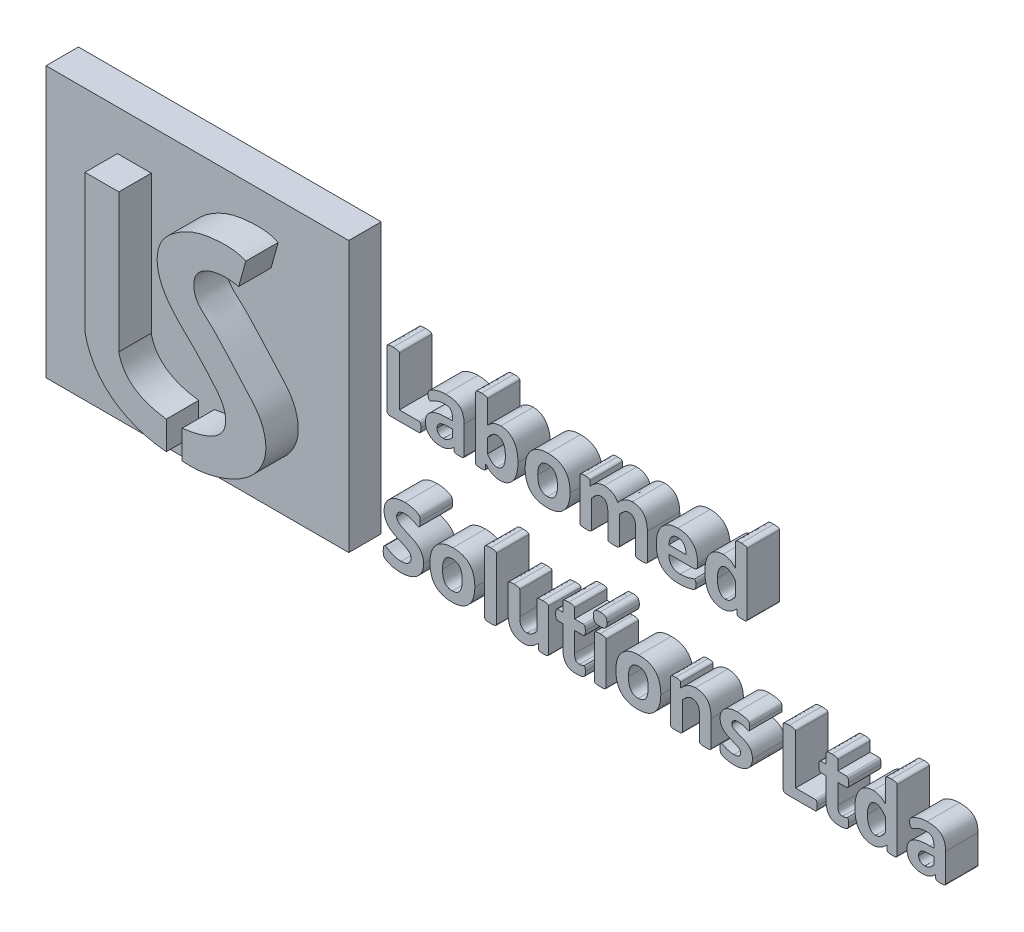
from build123d import *

# Parameters (mm, degrees)
RESSALTO_EXTRUS_O1_DEPTH    = 3
RESSALTO_EXTRUS_O1_2_DEPTH  = 3
RESSALTO_EXTRUS_O1_3_DEPTH  = 3
RESSALTO_EXTRUS_O1_4_DEPTH  = 3
RESSALTO_EXTRUS_O1_5_DEPTH  = 3
RESSALTO_EXTRUS_O1_6_DEPTH  = 3
RESSALTO_EXTRUS_O1_7_DEPTH  = 3
RESSALTO_EXTRUS_O1_8_DEPTH  = 3
RESSALTO_EXTRUS_O1_9_DEPTH  = 3
RESSALTO_EXTRUS_O1_10_DEPTH = 3
RESSALTO_EXTRUS_O1_11_DEPTH = 3
RESSALTO_EXTRUS_O1_12_DEPTH = 3
RESSALTO_EXTRUS_O1_13_DEPTH = 3
RESSALTO_EXTRUS_O1_14_DEPTH = 3
RESSALTO_EXTRUS_O1_15_DEPTH = 3
RESSALTO_EXTRUS_O1_16_DEPTH = 3
RESSALTO_EXTRUS_O1_17_DEPTH = 3
RESSALTO_EXTRUS_O1_18_DEPTH = 3
RESSALTO_EXTRUS_O1_19_DEPTH = 3
RESSALTO_EXTRUS_O1_20_DEPTH = 3
RESSALTO_EXTRUS_O1_21_DEPTH = 3
ESBO_O2_W                   = 28.005258982
ESBO_O2_H                   = 25
RESSALTO_EXTRUS_O2_DEPTH    = 3
RESSALTO_EXTRUS_O3_DEPTH    = 3


with BuildPart() as part:
    # Esboço1 → Ressalto-extrusão1 (new body)
    with BuildSketch(Plane.XY):
        with BuildLine():
            add(Edge.make_bspline(
                [(5.097518408, 4.874943444), (5.097291952, 4.836394076), (5.096873882, 4.765226334), (5.087347976, 4.668173119), (5.075306835, 4.58741636), (5.056314467, 4.522645831), (5.032509164, 4.471201861), (5.000743715, 4.434963193), (4.961311561, 4.415274703), (4.933692556, 4.412734093), (4.919648176, 4.411442182)],
                knots=[0, 0, 0, 0, 1.69995762, 3.138369049, 4.299922826, 5.296754232, 6.108045987, 6.783725302, 7.381519227, 8, 8, 8, 8], degree=3))
            Line((4.919648176, 4.411442182), (2.286649407, 4.411442182))
            add(Edge.make_bspline(
                [(2.286649407, 4.411442182), (2.263211823, 4.412430787), (2.217517497, 4.414358191), (2.151465009, 4.42964158), (2.092560093, 4.458313532), (2.037715765, 4.493953101), (1.992514684, 4.544390766), (1.960905522, 4.609420026), (1.943582479, 4.687094898), (1.941238066, 4.742860171), (1.939997202, 4.772375938)],
                knots=[0, 0, 0, 0, 0.988206998, 1.926625728, 2.832905899, 3.739002297, 4.669579943, 5.648984647, 6.755640938, 8, 8, 8, 8], degree=3))
            Line((1.939997202, 4.772375938), (1.939997202, 9.878679765))
            add(Edge.make_bspline(
                [(1.939997202, 9.878679765), (1.941626583, 9.892811388), (1.944869901, 9.920940682), (1.968319588, 9.960340634), (2.008236572, 9.993936303), (2.068774716, 10.017068243), (2.147803421, 10.035734567), (2.249837076, 10.051103467), (2.376893978, 10.061328007), (2.47055367, 10.061596709), (2.521645845, 10.061743288)],
                knots=[0, 0, 0, 0, 0.51358715, 1.022306066, 1.626293916, 2.38232859, 3.357940148, 4.587254232, 6.138317588, 8, 8, 8, 8], degree=3))
            add(Edge.make_bspline(
                [(2.521645845, 10.061743288), (2.573608993, 10.061647031), (2.667712445, 10.061472713), (2.795152595, 10.050953173), (2.896440705, 10.035978879), (2.974820487, 10.016807772), (3.035255869, 9.994050153), (3.074599069, 9.959917152), (3.100297502, 9.921465326), (3.102299266, 9.892887747), (3.103294488, 9.878679765)],
                knots=[0, 0, 0, 0, 1.891840835, 3.426057895, 4.654471675, 5.614083843, 6.369564826, 6.973110337, 7.489458814, 8, 8, 8, 8], degree=3))
            Line((3.103294488, 9.878679765), (3.103294488, 5.325461478))
            Line((3.103294488, 5.325461478), (4.919648176, 5.325461478))
            add(Edge.make_bspline(
                [(4.919648176, 5.325461478), (4.93377009, 5.324815891), (4.961210271, 5.323561455), (4.998743842, 5.30267243), (5.031072842, 5.270407618), (5.054845086, 5.221929394), (5.076371561, 5.160364987), (5.086935451, 5.080736755), (5.097046714, 4.984269238), (5.097352024, 4.913506857), (5.097518408, 4.874943444)],
                knots=[0, 0, 0, 0, 0.628853991, 1.221921344, 1.883771067, 2.660348459, 3.628496149, 4.814630856, 6.264067687, 8, 8, 8, 8], degree=3))
        make_face()
    extrude(amount=RESSALTO_EXTRUS_O1_DEPTH)


with BuildPart() as body_2:
    # Esboço1 → Ressalto-extrus_o1 2 (new body)
    with BuildSketch(Plane.XY):
        with BuildLine():
            add(Edge.make_bspline(
                [(9.085966249, 4.57373254), (9.084514196, 4.554407546), (9.081693314, 4.516865155), (9.041572389, 4.470691071), (8.979769762, 4.443337689), (8.914956954, 4.427350025), (8.848474685, 4.419903617), (8.784859232, 4.414418436), (8.709461121, 4.412489943), (8.655354569, 4.411807753), (8.626359954, 4.411442182)],
                knots=[0, 0, 0, 0, 0.847661055, 1.646739115, 2.582838834, 3.842570661, 4.623823176, 5.576626076, 6.701362571, 8, 8, 8, 8], degree=3))
            add(Edge.make_bspline(
                [(8.626359954, 4.411442182), (8.595630109, 4.411738538), (8.538919532, 4.412285452), (8.460572004, 4.414967992), (8.395541641, 4.41821591), (8.330304381, 4.425883155), (8.268631843, 4.441495258), (8.211365814, 4.47054615), (8.179705675, 4.518899279), (8.177184174, 4.554683679), (8.17584192, 4.57373254)],
                knots=[0, 0, 0, 0, 1.386548692, 2.558814494, 3.536916243, 4.324071477, 5.517771642, 6.401890461, 7.149289469, 8, 8, 8, 8], degree=3))
            Line((8.17584192, 4.57373254), (8.17584192, 4.884031704))
            add(Edge.make_bspline(
                [(8.17584192, 4.884031704), (8.135049249, 4.842543105), (8.053903533, 4.760013033), (7.919589686, 4.65127011), (7.776989628, 4.55578491), (7.626765496, 4.473670182), (7.467453139, 4.407415629), (7.298297424, 4.36313803), (7.121387117, 4.332884803), (7.000125161, 4.329877054), (6.93854023, 4.328349518)],
                knots=[0, 0, 0, 0, 0.999025191, 1.987283781, 2.962731982, 3.94425428, 4.924621166, 5.918486269, 6.942868133, 8, 8, 8, 8], degree=3))
            add(Edge.make_bspline(
                [(6.93854023, 4.328349518), (6.887424432, 4.329253008), (6.787542273, 4.331018461), (6.641003444, 4.347609096), (6.500643421, 4.371516321), (6.366761227, 4.406457023), (6.240796908, 4.451807205), (6.123141959, 4.506762905), (6.013396696, 4.570128152), (5.912871243, 4.644222696), (5.823080937, 4.729154397), (5.743275808, 4.823147852), (5.674364933, 4.92651338), (5.614842344, 5.038600849), (5.570018901, 5.162012732), (5.535858548, 5.294472697), (5.516502511, 5.437414053), (5.514179456, 5.535732771), (5.512981725, 5.586424374)],
                knots=[0, 0, 0, 0, 1.140483104, 2.228546132, 3.287799885, 4.316350563, 5.312457115, 6.271822403, 7.211186946, 8.136591208, 9.052264771, 9.963802042, 10.88273062, 11.820305517, 12.789203481, 13.805984309, 14.868799623, 16, 16, 16, 16], degree=3))
            add(Edge.make_bspline(
                [(5.512981725, 5.586424374), (5.514108877, 5.641082764), (5.516296649, 5.747173288), (5.543813865, 5.900355791), (5.584346759, 6.043013928), (5.643635566, 6.174492895), (5.719324724, 6.294576301), (5.811526835, 6.403794868), (5.920500619, 6.501691341), (6.046276712, 6.588968708), (6.188593921, 6.665120759), (6.346248687, 6.731566654), (6.520357313, 6.785588403), (6.710457236, 6.829571928), (6.916631263, 6.862259447), (7.138396195, 6.887279113), (7.375899997, 6.901061025), (7.539647125, 6.903146877), (7.624054703, 6.904222082)],
                knots=[0, 0, 0, 0, 0.930281648, 1.805652644, 2.643434735, 3.452148082, 4.254209686, 5.054947895, 5.879940667, 6.7433, 7.657362619, 8.625742791, 9.654340048, 10.759876155, 11.948048164, 13.209575455, 14.561605444, 16, 16, 16, 16], degree=3))
            Line((7.624054703, 6.904222082), (8.005761625, 6.904222082))
            Line((8.005761625, 6.904222082), (8.005761625, 7.14830678))
            add(Edge.make_bspline(
                [(8.005761625, 7.14830678), (8.004448622, 7.20776249), (8.001986722, 7.319242793), (7.9728216, 7.474865746), (7.927619138, 7.609822349), (7.851284608, 7.7192239), (7.750548948, 7.806878077), (7.643362136, 7.851875158), (7.546482319, 7.877097265), (7.463451864, 7.890826559), (7.371971091, 7.900419504), (7.308157952, 7.901020125), (7.274805852, 7.901334042)],
                knots=[0, 0, 0, 0, 1.458536489, 2.734776677, 3.878437504, 4.92544373, 5.973744821, 7.115921979, 7.742601458, 8.433051669, 9.181030477, 10, 10, 10, 10], degree=3))
            add(Edge.make_bspline(
                [(7.274805852, 7.901334042), (7.2306381, 7.900608478), (7.144736466, 7.899197332), (7.019255148, 7.887603749), (6.90115024, 7.867088364), (6.757327047, 7.828783249), (6.592941518, 7.773746846), (6.417195759, 7.698479061), (6.26662059, 7.625014663), (6.159676307, 7.564950685), (6.087168243, 7.521778375), (6.038880459, 7.503721441), (5.996900927, 7.488154124), (5.969672777, 7.486595628), (5.957008145, 7.485870725)],
                knots=[0, 0, 0, 0, 1.136757713, 2.210874221, 3.240152045, 4.21824245, 6.039499857, 7.696795992, 9.13659946, 10.348440785, 10.856985134, 11.301743508, 11.67521988, 12, 12, 12, 12], degree=3))
            add(Edge.make_bspline(
                [(5.957008145, 7.485870725), (5.94160245, 7.487450459), (5.911446394, 7.490542728), (5.8693201, 7.513449827), (5.836275479, 7.551323443), (5.808166824, 7.601168691), (5.789183405, 7.663757128), (5.773136194, 7.737048274), (5.764973505, 7.821100843), (5.763193184, 7.880549927), (5.762259715, 7.911720625)],
                knots=[0, 0, 0, 0, 0.718163752, 1.405777981, 2.178533946, 3.038943502, 4.062203321, 5.22045479, 6.542612302, 8, 8, 8, 8], degree=3))
            add(Edge.make_bspline(
                [(5.762259715, 7.911720625), (5.76314168, 7.950671976), (5.764709291, 8.019904384), (5.778007188, 8.115630665), (5.813190892, 8.193350655), (5.856909503, 8.249174376), (5.904717588, 8.291187), (5.952985981, 8.325628253), (6.012124295, 8.363394874), (6.108548953, 8.420541614), (6.248769849, 8.492784051), (6.439838119, 8.567297378), (6.651001722, 8.637124144), (6.881768234, 8.688980425), (7.12520558, 8.725906996), (7.291977021, 8.730130755), (7.376075036, 8.732260675)],
                knots=[0, 0, 0, 0, 0.826658441, 1.469308558, 2.032047218, 2.613912067, 2.958349689, 3.378648177, 3.869887561, 4.445861981, 5.754983526, 7.20845133, 8.789953761, 10.466056555, 12.217934526, 14, 14, 14, 14], degree=3))
            add(Edge.make_bspline(
                [(7.376075036, 8.732260675), (7.449244502, 8.731412296), (7.590601498, 8.729773302), (7.794087393, 8.713145911), (7.98096298, 8.684432382), (8.151965233, 8.646365553), (8.30756701, 8.595444005), (8.449057131, 8.533979484), (8.574768816, 8.457320994), (8.687816887, 8.370414347), (8.786075662, 8.269365612), (8.869818676, 8.15528828), (8.939307837, 8.027833303), (8.993431366, 7.886542), (9.03395154, 7.732189463), (9.06623087, 7.565380247), (9.081639, 7.38445651), (9.084492606, 7.259549938), (9.085966249, 7.195046403)],
                knots=[0, 0, 0, 0, 1.317245853, 2.544803546, 3.672193757, 4.719393239, 5.695189719, 6.61611763, 7.490092295, 8.339581991, 9.177158916, 10.01874955, 10.880057752, 11.783008764, 12.735695387, 13.750474329, 14.838312871, 16, 16, 16, 16], degree=3))
            Line((9.085966249, 7.195046403), (9.085966249, 4.57373254))
        make_face()
        with BuildLine():
            Line((8.005761625, 6.239480775), (7.585105017, 6.239480775))
            add(Edge.make_bspline(
                [(7.585105017, 6.239480775), (7.542247162, 6.23901853), (7.459485338, 6.238125899), (7.340322976, 6.230330527), (7.230590083, 6.21770326), (7.131013151, 6.199314161), (7.039813144, 6.178042777), (6.958623803, 6.148912836), (6.884564052, 6.117386127), (6.802282495, 6.06605006), (6.714901201, 5.992861922), (6.64243677, 5.881971893), (6.60090727, 5.75461029), (6.59583798, 5.664643649), (6.593186348, 5.617584123)],
                knots=[0, 0, 0, 0, 1.163507281, 2.246822312, 3.240808781, 4.16040749, 4.99541618, 5.779516542, 6.500121047, 7.175220986, 8.407704522, 9.56138043, 10.724412955, 12, 12, 12, 12], degree=3))
            add(Edge.make_bspline(
                [(6.593186348, 5.617584123), (6.595259779, 5.577615427), (6.599239432, 5.500901265), (6.627348761, 5.391799782), (6.678425469, 5.297585955), (6.746810096, 5.216758873), (6.833356613, 5.152523766), (6.936624791, 5.10846759), (7.053923104, 5.080553619), (7.137443078, 5.077688759), (7.181326606, 5.076183488)],
                knots=[0, 0, 0, 0, 1.059950426, 2.034422386, 2.958730888, 3.878753548, 4.822247058, 5.788368866, 6.837952474, 8, 8, 8, 8], degree=3))
            add(Edge.make_bspline(
                [(7.181326606, 5.076183488), (7.219545703, 5.07759976), (7.294988436, 5.080395415), (7.404953959, 5.105098895), (7.510555243, 5.142675638), (7.611285521, 5.197705317), (7.711129371, 5.265752276), (7.808483418, 5.350241006), (7.91019224, 5.444518001), (7.973089758, 5.516549714), (8.005761625, 5.553966303)],
                knots=[0, 0, 0, 0, 0.93008171, 1.83593838, 2.733223734, 3.653087759, 4.624110121, 5.671802727, 6.790627123, 8, 8, 8, 8], degree=3))
            Line((8.005761625, 5.553966303), (8.005761625, 6.239480775))
        make_face(mode=Mode.SUBTRACT)
    extrude(amount=RESSALTO_EXTRUS_O1_2_DEPTH)


with BuildPart() as body_3:
    # Esboço1 → Ressalto-extrus_o1 3 (new body)
    with BuildSketch(Plane.XY):
        with BuildLine():
            add(Edge.make_bspline(
                [(14.071526049, 6.582238011), (14.070593992, 6.497786326), (14.068769486, 6.332471548), (14.045371983, 6.091516579), (14.011900867, 5.862921504), (13.960260092, 5.64902362), (13.89905115, 5.448405815), (13.823306047, 5.262921854), (13.735334102, 5.092131677), (13.634029203, 4.937143), (13.520190653, 4.798086774), (13.394397685, 4.675368702), (13.25474458, 4.57069964), (13.104574103, 4.481936586), (12.942144995, 4.41290804), (12.769206124, 4.362985877), (12.585008221, 4.334722296), (12.458670283, 4.33050512), (12.394092908, 4.328349518)],
                knots=[0, 0, 0, 0, 1.280875039, 2.507322067, 3.670044118, 4.783359328, 5.84257178, 6.849786206, 7.818974621, 8.753278866, 9.653742339, 10.540696889, 11.412722975, 12.295657796, 13.181152737, 14.083123303, 15.02019245, 16, 16, 16, 16], degree=3))
            add(Edge.make_bspline(
                [(12.394092908, 4.328349518), (12.330827689, 4.330085334), (12.207572695, 4.333467096), (12.027867019, 4.360071029), (11.858734233, 4.410779687), (11.697148291, 4.482395359), (11.543163958, 4.580191201), (11.389471043, 4.696569953), (11.236685817, 4.83893969), (11.139125461, 4.946035062), (11.087980106, 5.002179085)],
                knots=[0, 0, 0, 0, 0.996486466, 1.941381656, 2.851653833, 3.770210855, 4.716162989, 5.7183467, 6.803858713, 8, 8, 8, 8], degree=3))
            Line((11.087980106, 5.002179085), (11.087980106, 4.584119123))
            add(Edge.make_bspline(
                [(11.087980106, 4.584119123), (11.087355972, 4.569165576), (11.086161113, 4.540538098), (11.066015848, 4.501355103), (11.032069059, 4.470002277), (10.983581542, 4.445819587), (10.918925044, 4.428047825), (10.837306383, 4.417401459), (10.737041386, 4.413443841), (10.66429531, 4.412150224), (10.624478843, 4.411442182)],
                knots=[0, 0, 0, 0, 0.650144634, 1.244654703, 1.875942385, 2.648992111, 3.598538488, 4.807113715, 6.25242187, 8, 8, 8, 8], degree=3))
            add(Edge.make_bspline(
                [(10.624478843, 4.411442182), (10.584246943, 4.41225669), (10.510667556, 4.413746328), (10.410133068, 4.416475477), (10.32938603, 4.430073374), (10.265592762, 4.44671942), (10.218229475, 4.471384421), (10.18500013, 4.50245035), (10.168690694, 4.542521254), (10.167042832, 4.570573632), (10.166170872, 4.585417446)],
                knots=[0, 0, 0, 0, 1.776114899, 3.248304124, 4.428560144, 5.383239892, 6.14363497, 6.764690652, 7.3463406, 8, 8, 8, 8], degree=3))
            Line((10.166170872, 4.585417446), (10.166170872, 10.290248113))
            add(Edge.make_bspline(
                [(10.166170872, 10.290248113), (10.167347602, 10.304355225), (10.169678408, 10.332297874), (10.191629125, 10.371483124), (10.228595902, 10.404814567), (10.2842615, 10.430191001), (10.357086804, 10.451833731), (10.452225182, 10.466338613), (10.570573416, 10.476921565), (10.658201251, 10.477105629), (10.706273184, 10.477206605)],
                knots=[0, 0, 0, 0, 0.541416831, 1.072410803, 1.687521586, 2.435103878, 3.41340893, 4.617109284, 6.144173072, 8, 8, 8, 8], degree=3))
            add(Edge.make_bspline(
                [(10.706273184, 10.477206605), (10.754346337, 10.477128947), (10.841545057, 10.476988085), (10.959877881, 10.466200418), (11.05446064, 10.451811631), (11.127794021, 10.431122618), (11.18370054, 10.406452353), (11.220910284, 10.372764783), (11.242649097, 10.33398702), (11.245138145, 10.30650604), (11.246375495, 10.292844758)],
                knots=[0, 0, 0, 0, 1.861055034, 3.375722335, 4.599345978, 5.559561821, 6.324280665, 6.941124295, 7.473614146, 8, 8, 8, 8], degree=3))
            Line((11.246375495, 10.292844758), (11.246375495, 8.176578489))
            add(Edge.make_bspline(
                [(11.246375495, 8.176578489), (11.295366462, 8.223332799), (11.3896606, 8.313321987), (11.539366607, 8.429964979), (11.688478307, 8.52639463), (11.838839069, 8.604292419), (11.990489405, 8.665500389), (12.148470917, 8.703778142), (12.31152821, 8.728072012), (12.422997798, 8.730847034), (12.479782217, 8.732260675)],
                knots=[0, 0, 0, 0, 1.167154803, 2.246452016, 3.266977309, 4.224899929, 5.163085194, 6.078922355, 7.021371852, 8, 8, 8, 8], degree=3))
            add(Edge.make_bspline(
                [(12.479782217, 8.732260675), (12.549160934, 8.730499714), (12.683542899, 8.727088848), (12.876945216, 8.694251914), (13.054015091, 8.640048462), (13.214145866, 8.563445054), (13.358973275, 8.469380712), (13.48981248, 8.359122728), (13.60732463, 8.234552903), (13.708629759, 8.093360651), (13.798486425, 7.940662344), (13.873378946, 7.773898514), (13.937723648, 7.596257223), (13.985301476, 7.406171771), (14.024641743, 7.208642626), (14.051090745, 7.004311795), (14.069003986, 6.795051653), (14.070679334, 6.653684453), (14.071526049, 6.582238011)],
                knots=[0, 0, 0, 0, 1.101394552, 2.133328044, 3.105350469, 4.034078143, 4.943701929, 5.841584092, 6.746283985, 7.656634971, 8.596417359, 9.556304319, 10.55662945, 11.593839889, 12.665764636, 13.754772664, 14.865270688, 16, 16, 16, 16], degree=3))
        make_face()
        with BuildLine():
            add(Edge.make_bspline(
                [(12.908228762, 6.505636962), (12.90667819, 6.589263098), (12.903631828, 6.753560765), (12.874044563, 6.992844849), (12.829680972, 7.216815744), (12.762120992, 7.384860634), (12.697663629, 7.504087741), (12.641891508, 7.582246728), (12.578341987, 7.650304084), (12.510034208, 7.710926025), (12.432607308, 7.760239201), (12.344755923, 7.793819124), (12.247981071, 7.815235488), (12.17999021, 7.817216497), (12.144814918, 7.818241378)],
                knots=[0, 0, 0, 0, 1.772102224, 3.48159413, 5.106858532, 6.59778487, 7.300081657, 7.977418037, 8.626767011, 9.270712515, 9.909736071, 10.560639133, 11.255341997, 12, 12, 12, 12], degree=3))
            add(Edge.make_bspline(
                [(12.144814918, 7.818241378), (12.108754986, 7.816836869), (12.036642934, 7.814028155), (11.92957824, 7.788018729), (11.822042726, 7.743513121), (11.71292946, 7.676146012), (11.60154809, 7.5847891), (11.48496009, 7.472048589), (11.364182621, 7.332184879), (11.287490199, 7.22600359), (11.246375495, 7.169079946)],
                knots=[0, 0, 0, 0, 0.749866143, 1.499569842, 2.279374405, 3.164887467, 4.158431375, 5.273651795, 6.538408439, 8, 8, 8, 8], degree=3))
            Line((11.246375495, 7.169079946), (11.246375495, 5.873353727))
            add(Edge.make_bspline(
                [(11.246375495, 5.873353727), (11.283421155, 5.824398837), (11.354156524, 5.73092386), (11.465453886, 5.604061221), (11.573624922, 5.495365596), (11.679293784, 5.403249779), (11.786772777, 5.331765193), (11.896365041, 5.280292314), (12.008913831, 5.248687677), (12.084899821, 5.244469574), (12.122743429, 5.242368815)],
                knots=[0, 0, 0, 0, 1.315874994, 2.512545413, 3.614771006, 4.602045193, 5.51303753, 6.37233575, 7.189367823, 8, 8, 8, 8], degree=3))
            add(Edge.make_bspline(
                [(12.122743429, 5.242368815), (12.156650259, 5.243301013), (12.223072781, 5.245127162), (12.317341481, 5.268451565), (12.405021341, 5.301971002), (12.482357385, 5.352400789), (12.552829231, 5.41320567), (12.617888954, 5.481493706), (12.674958987, 5.559441481), (12.745686014, 5.673894815), (12.817028563, 5.836947769), (12.869393856, 6.051943235), (12.902289335, 6.276976067), (12.906258639, 6.429789579), (12.908228762, 6.505636962)],
                knots=[0, 0, 0, 0, 0.736767962, 1.44330761, 2.103222642, 2.772695862, 3.441372247, 4.128206638, 4.821991929, 5.541430362, 7.056531058, 8.672958675, 10.348657955, 12, 12, 12, 12], degree=3))
        make_face(mode=Mode.SUBTRACT)
    extrude(amount=RESSALTO_EXTRUS_O1_3_DEPTH)


with BuildPart() as body_4:
    # Esboço1 → Ressalto-extrus_o1 4 (new body)
    with BuildSketch(Plane.XY):
        with BuildLine():
            add(Edge.make_bspline(
                [(18.890900522, 6.569254783), (18.889568124, 6.487828757), (18.886960637, 6.328478913), (18.861730461, 6.09490933), (18.820222555, 5.872279518), (18.763350959, 5.660725379), (18.691603245, 5.460717834), (18.599695764, 5.276045558), (18.49334729, 5.103945952), (18.367870449, 4.948305656), (18.227209645, 4.806145268), (18.067601748, 4.683118492), (17.892064288, 4.575335712), (17.699300873, 4.486383118), (17.490008524, 4.413865362), (17.26341804, 4.364359049), (17.019972856, 4.334093148), (16.852193773, 4.330305573), (16.765545993, 4.328349518)],
                knots=[0, 0, 0, 0, 1.113319589, 2.178754308, 3.208455642, 4.207768461, 5.172113168, 6.109170422, 7.023922825, 7.933509535, 8.837532971, 9.752744837, 10.682596161, 11.649118131, 12.650532189, 13.705973307, 14.815273536, 16, 16, 16, 16], degree=3))
            add(Edge.make_bspline(
                [(16.765545993, 4.328349518), (16.681928287, 4.329904305), (16.52027784, 4.332910031), (16.286345197, 4.361368253), (16.068412751, 4.403779032), (15.867676145, 4.468116198), (15.683130632, 4.548283899), (15.515860238, 4.64665113), (15.363629629, 4.760052425), (15.228171494, 4.890588778), (15.108584767, 5.037183595), (15.007973985, 5.200779962), (14.920971276, 5.378637917), (14.853052848, 5.573302124), (14.800025974, 5.782758897), (14.762929422, 6.006422198), (14.740722948, 6.244223331), (14.737781947, 6.407347676), (14.736267355, 6.491355411)],
                knots=[0, 0, 0, 0, 1.181446855, 2.283982906, 3.32655743, 4.315185786, 5.257453973, 6.165006088, 7.052038359, 7.934650827, 8.817454076, 9.718799644, 10.643569204, 11.611018613, 12.627364875, 13.694419645, 14.812644531, 16, 16, 16, 16], degree=3))
            add(Edge.make_bspline(
                [(14.736267355, 6.491355411), (14.737412696, 6.572806888), (14.739660827, 6.732683808), (14.767637795, 6.966287772), (14.806024824, 7.190023538), (14.865646012, 7.401509866), (14.937700379, 7.602312166), (15.031659263, 7.786789539), (15.137261573, 7.959156145), (15.263658413, 8.114102134), (15.404597136, 8.255019809), (15.56395024, 8.37785736), (15.738743084, 8.48490032), (15.930735143, 8.574579138), (16.139401296, 8.646466588), (16.365433279, 8.69644123), (16.608072829, 8.726424126), (16.775410974, 8.730276151), (16.861621885, 8.732260675)],
                knots=[0, 0, 0, 0, 1.113913748, 2.186444051, 3.215622068, 4.217027877, 5.189490374, 6.129681182, 7.044921772, 7.95037712, 8.859080193, 9.766470112, 10.696817681, 11.658491327, 12.660439822, 13.710666327, 14.82055857, 16, 16, 16, 16], degree=3))
            add(Edge.make_bspline(
                [(16.861621885, 8.732260675), (16.945637575, 8.730458869), (17.10846483, 8.726966864), (17.344196687, 8.70178456), (17.562229869, 8.655967707), (17.763366591, 8.594019738), (17.947829306, 8.514840222), (18.115444974, 8.417895743), (18.267267719, 8.305169587), (18.400441883, 8.173472171), (18.517990083, 8.027074814), (18.620290421, 7.86495756), (18.704116273, 7.685713165), (18.773126449, 7.491320131), (18.82535323, 7.281570772), (18.864939608, 7.057402353), (18.886226408, 6.81808143), (18.88931455, 6.653684073), (18.890900522, 6.569254783)],
                knots=[0, 0, 0, 0, 1.186385251, 2.299283063, 3.342062402, 4.327876729, 5.266769255, 6.170349148, 7.056503717, 7.92947335, 8.807562083, 9.702836837, 10.629557278, 11.596049415, 12.61139002, 13.678422049, 14.807710892, 16, 16, 16, 16], degree=3))
        make_face()
        with BuildLine():
            add(Edge.make_bspline(
                [(17.727603235, 6.521216837), (17.725966886, 6.6113367), (17.722822979, 6.784483392), (17.694187433, 6.995305674), (17.6591793, 7.150586617), (17.627566806, 7.25807779), (17.585239651, 7.356599526), (17.53781027, 7.448127136), (17.481676157, 7.530959293), (17.416149066, 7.604232346), (17.341842621, 7.668477704), (17.257787467, 7.721962798), (17.164599918, 7.765400385), (17.060267788, 7.796909364), (16.944442159, 7.814446684), (16.863411471, 7.816945189), (16.821373876, 7.818241378)],
                knots=[0, 0, 0, 0, 2.099323923, 4.033417037, 4.943569222, 5.808157329, 6.639824559, 7.438360133, 8.207635794, 8.964783526, 9.722871064, 10.489431353, 11.2790645, 12.111770665, 13.020412873, 14, 14, 14, 14], degree=3))
            add(Edge.make_bspline(
                [(16.821373876, 7.818241378), (16.783651344, 7.817413497), (16.709968192, 7.815796401), (16.603325411, 7.798299799), (16.503880561, 7.771350477), (16.412179132, 7.733518122), (16.327733084, 7.684884747), (16.251400124, 7.625285061), (16.183051217, 7.554978796), (16.121746822, 7.476114911), (16.070449981, 7.386661387), (16.024480565, 7.289982779), (15.985815838, 7.184285701), (15.953379808, 7.070229968), (15.928840186, 6.947791183), (15.912473088, 6.817160184), (15.901924974, 6.678485663), (15.900364968, 6.583123521), (15.899564642, 6.534200065)],
                knots=[0, 0, 0, 0, 1.00945374, 1.971758796, 2.885659607, 3.763877744, 4.620725595, 5.487859729, 6.348462272, 7.241019303, 8.155434469, 9.104242688, 10.105411123, 11.165751776, 12.277308735, 13.446129053, 14.689792532, 16, 16, 16, 16], degree=3))
            add(Edge.make_bspline(
                [(15.899564642, 6.534200065), (15.901867036, 6.444532605), (15.906311429, 6.271444269), (15.933590912, 6.060343249), (15.970150505, 5.905051149), (16.004599303, 5.798482235), (16.044088751, 5.699164828), (16.090548624, 5.606974758), (16.146912457, 5.524576385), (16.211858363, 5.451069616), (16.287150976, 5.388476976), (16.370577044, 5.334100917), (16.465032657, 5.293036958), (16.569139896, 5.262436757), (16.684132842, 5.246518798), (16.764205572, 5.243787438), (16.805794001, 5.242368815)],
                knots=[0, 0, 0, 0, 2.094018324, 4.042159181, 4.956502668, 5.816266793, 6.655165731, 7.450694222, 8.221574423, 8.9803014, 9.733420861, 10.501580027, 11.297878509, 12.129439997, 13.028462611, 14, 14, 14, 14], degree=3))
            add(Edge.make_bspline(
                [(16.805794001, 5.242368815), (16.844388152, 5.243142799), (16.918948741, 5.244638069), (17.026818522, 5.262512921), (17.126805916, 5.289022179), (17.218933363, 5.327041839), (17.302896158, 5.375861891), (17.380026275, 5.433951511), (17.447737557, 5.503835003), (17.507692001, 5.582633377), (17.561185599, 5.6698626), (17.606702025, 5.766571742), (17.64358896, 5.872138676), (17.675505596, 5.985584301), (17.697515571, 6.108326627), (17.716853467, 6.238502226), (17.724672971, 6.377445472), (17.726606467, 6.472311106), (17.727603235, 6.521216837)],
                knots=[0, 0, 0, 0, 1.03343849, 1.996514537, 2.922333684, 3.801255442, 4.658789792, 5.519534866, 6.380826916, 7.257832891, 8.169002078, 9.118570472, 10.116571487, 11.163463741, 12.273671298, 13.456468979, 14.688742805, 16, 16, 16, 16], degree=3))
        make_face(mode=Mode.SUBTRACT)
    extrude(amount=RESSALTO_EXTRUS_O1_4_DEPTH)


with BuildPart() as body_5:
    # Esboço1 → Ressalto-extrus_o1 5 (new body)
    with BuildSketch(Plane.XY):
        with BuildLine():
            add(Edge.make_bspline(
                [(26.036869569, 4.586715768), (26.035659167, 4.572645447), (26.033261664, 4.544775672), (26.012111679, 4.505546798), (25.973613282, 4.47509259), (25.919879485, 4.450581427), (25.846707703, 4.433652954), (25.753044742, 4.419355934), (25.634472646, 4.412721767), (25.54740293, 4.411897149), (25.499363903, 4.411442182)],
                knots=[0, 0, 0, 0, 0.546933965, 1.083338861, 1.682284588, 2.430085425, 3.372120221, 4.602076982, 6.125261863, 8, 8, 8, 8], degree=3))
            add(Edge.make_bspline(
                [(25.499363903, 4.411442182), (25.450036141, 4.411943454), (25.360821579, 4.412850058), (25.240411034, 4.418892721), (25.14529012, 4.434453207), (25.070875266, 4.449930356), (25.016312052, 4.474799575), (24.978713856, 4.505132735), (24.960819481, 4.544062761), (24.958071197, 4.570560607), (24.956664945, 4.584119123)],
                knots=[0, 0, 0, 0, 1.911771993, 3.457645241, 4.662330009, 5.646474877, 6.38898643, 6.971033279, 7.473494544, 8, 8, 8, 8], degree=3))
            Line((24.956664945, 4.584119123), (24.956664945, 6.867869042))
            add(Edge.make_bspline(
                [(24.956664945, 6.867869042), (24.955365671, 6.929911928), (24.952877264, 7.048738216), (24.921940269, 7.217033359), (24.875888157, 7.367189779), (24.806291104, 7.495265285), (24.71747409, 7.601401834), (24.623884155, 7.665475019), (24.541037448, 7.701825547), (24.472488365, 7.721328116), (24.397930984, 7.733127324), (24.346066164, 7.73445874), (24.319188419, 7.735148715)],
                knots=[0, 0, 0, 0, 1.527648431, 2.925795387, 4.204647982, 5.384065936, 6.496265036, 7.585449739, 8.144484545, 8.721951796, 9.337681054, 10, 10, 10, 10], degree=3))
            add(Edge.make_bspline(
                [(24.319188419, 7.735148715), (24.285244582, 7.733405541), (24.215756392, 7.729836999), (24.112096267, 7.699356015), (24.008915777, 7.650359059), (23.905354319, 7.582595203), (23.800874576, 7.496518247), (23.689169822, 7.396735597), (23.576317314, 7.276392109), (23.500532543, 7.189658933), (23.460997005, 7.144411812)],
                knots=[0, 0, 0, 0, 0.75821189, 1.552174868, 2.396765844, 3.307159794, 4.312664983, 5.423074121, 6.655664637, 8, 8, 8, 8], degree=3))
            Line((23.460997005, 7.144411812), (23.460997005, 4.584119123))
            add(Edge.make_bspline(
                [(23.460997005, 4.584119123), (23.459802939, 4.570454345), (23.457434342, 4.543348361), (23.43575013, 4.505416316), (23.397540256, 4.474721126), (23.34220441, 4.450472657), (23.267742487, 4.43400439), (23.173713684, 4.419352345), (23.056436206, 4.412748824), (22.970664528, 4.411905821), (22.923491339, 4.411442182)],
                knots=[0, 0, 0, 0, 0.532526038, 1.056339406, 1.657849211, 2.424204676, 3.403141999, 4.638364188, 6.151148699, 8, 8, 8, 8], degree=3))
            add(Edge.make_bspline(
                [(22.923491339, 4.411442182), (22.87502375, 4.411929851), (22.787097029, 4.41281455), (22.668041875, 4.419061989), (22.573635556, 4.434148425), (22.499583596, 4.450463079), (22.444249385, 4.474722884), (22.406039206, 4.505415956), (22.384355058, 4.543348447), (22.381986453, 4.570454374), (22.380792382, 4.584119123)],
                knots=[0, 0, 0, 0, 1.88372035, 3.417321853, 4.625520026, 5.596212519, 6.356113567, 6.952557321, 7.471959016, 8, 8, 8, 8], degree=3))
            Line((22.380792382, 4.584119123), (22.380792382, 6.867869042))
            add(Edge.make_bspline(
                [(22.380792382, 6.867869042), (22.379528058, 6.929920976), (22.377106588, 7.048764592), (22.34573737, 7.216811419), (22.301323087, 7.367041178), (22.233117327, 7.495527128), (22.143973628, 7.601840432), (22.029886743, 7.678672607), (21.894632894, 7.727639897), (21.796989985, 7.732569838), (21.745912501, 7.735148715)],
                knots=[0, 0, 0, 0, 1.223960539, 2.344163765, 3.366180896, 4.307068031, 5.198168223, 6.077877447, 6.99452828, 8, 8, 8, 8], degree=3))
            add(Edge.make_bspline(
                [(21.745912501, 7.735148715), (21.711101413, 7.73344051), (21.640324348, 7.729967429), (21.534951261, 7.699389354), (21.430493155, 7.650371739), (21.325794804, 7.582956189), (21.221177594, 7.496896566), (21.110791422, 7.396185008), (20.997808488, 7.277197423), (20.923640252, 7.189798408), (20.885124442, 7.144411812)],
                knots=[0, 0, 0, 0, 0.775016021, 1.57574385, 2.426386301, 3.341994921, 4.344287926, 5.444016397, 6.672669285, 8, 8, 8, 8], degree=3))
            Line((20.885124442, 7.144411812), (20.885124442, 4.584119123))
            add(Edge.make_bspline(
                [(20.885124442, 4.584119123), (20.883930425, 4.570454145), (20.881561925, 4.543347762), (20.859876954, 4.505418809), (20.821670685, 4.474708929), (20.766703418, 4.450708449), (20.69279412, 4.433778583), (20.598697928, 4.419332848), (20.480132615, 4.412729742), (20.393061777, 4.411899984), (20.34502213, 4.411442182)],
                knots=[0, 0, 0, 0, 0.530246659, 1.05181794, 1.650753093, 2.413828315, 3.372201923, 4.60213697, 6.12529496, 8, 8, 8, 8], degree=3))
            add(Edge.make_bspline(
                [(20.34502213, 4.411442182), (20.296989918, 4.411941824), (20.209500851, 4.412851905), (20.090849631, 4.419021268), (19.996521334, 4.434256259), (19.922645373, 4.450091337), (19.868182997, 4.475118304), (19.829674063, 4.505541908), (19.808745495, 4.544385936), (19.806190134, 4.571792939), (19.804919819, 4.585417446)],
                knots=[0, 0, 0, 0, 1.870946894, 3.407867196, 4.618679977, 5.591473102, 6.337761678, 6.935496169, 7.470816306, 8, 8, 8, 8], degree=3))
            Line((19.804919819, 4.585417446), (19.804919819, 8.475192748))
            add(Edge.make_bspline(
                [(19.804919819, 8.475192748), (19.805859507, 8.488758668), (19.807687463, 8.515148162), (19.824535271, 8.553616594), (19.857611419, 8.585650823), (19.907724832, 8.607844217), (19.971228133, 8.627403753), (20.053038554, 8.638944299), (20.153499269, 8.648651546), (20.227702465, 8.64898502), (20.268421081, 8.649168012)],
                knots=[0, 0, 0, 0, 0.596235284, 1.159843756, 1.807279437, 2.575043709, 3.552545928, 4.731668383, 6.20652006, 8, 8, 8, 8], degree=3))
            add(Edge.make_bspline(
                [(20.268421081, 8.649168012), (20.310015074, 8.649021551), (20.385532643, 8.64875564), (20.487613153, 8.63872114), (20.569355191, 8.628166409), (20.630389365, 8.607870031), (20.677576355, 8.585849855), (20.705334367, 8.551965593), (20.724450503, 8.515625461), (20.725958939, 8.488858367), (20.726729053, 8.475192748)],
                knots=[0, 0, 0, 0, 1.84556318, 3.350783037, 4.557851518, 5.487811293, 6.21030578, 6.823254204, 7.39922654, 8, 8, 8, 8], degree=3))
            Line((20.726729053, 8.475192748), (20.726729053, 8.025973037))
            add(Edge.make_bspline(
                [(20.726729053, 8.025973037), (20.780341277, 8.0823224), (20.883879236, 8.191146425), (21.048993339, 8.333546534), (21.210516017, 8.457572147), (21.374590269, 8.55664348), (21.539215498, 8.637382951), (21.708839676, 8.690375826), (21.881082052, 8.727234827), (21.99759216, 8.73057842), (22.056211666, 8.732260675)],
                knots=[0, 0, 0, 0, 1.202891135, 2.323068911, 3.370513955, 4.350254715, 5.284893987, 6.199842184, 7.094290084, 8, 8, 8, 8], degree=3))
            add(Edge.make_bspline(
                [(22.056211666, 8.732260675), (22.133440228, 8.730030251), (22.280255389, 8.725790109), (22.488821541, 8.686904204), (22.675474963, 8.627147475), (22.839431603, 8.540797741), (22.984384345, 8.437252023), (23.105840916, 8.311507046), (23.208656632, 8.169934781), (23.261552989, 8.065723638), (23.288320064, 8.012989808)],
                knots=[0, 0, 0, 0, 1.221059254, 2.321291566, 3.345750548, 4.31071812, 5.242294198, 6.152836, 7.065282004, 8, 8, 8, 8], degree=3))
            add(Edge.make_bspline(
                [(23.288320064, 8.012989808), (23.345913266, 8.072700784), (23.455896749, 8.1867285), (23.627561693, 8.337648123), (23.795900646, 8.463387092), (23.9635908, 8.563088921), (24.129494544, 8.64026012), (24.296948597, 8.691835324), (24.465312998, 8.726734601), (24.579113011, 8.73041938), (24.635979198, 8.732260675)],
                knots=[0, 0, 0, 0, 1.265052411, 2.415821097, 3.482674136, 4.46540851, 5.387110681, 6.266119817, 7.133575181, 8, 8, 8, 8], degree=3))
            add(Edge.make_bspline(
                [(24.635979198, 8.732260675), (24.698821792, 8.730998954), (24.819841641, 8.72856918), (24.994019392, 8.703488231), (25.152874784, 8.662780785), (25.296453833, 8.60466083), (25.425377781, 8.533297407), (25.540788329, 8.448953136), (25.644324096, 8.354502766), (25.732729992, 8.246428865), (25.809786544, 8.128937319), (25.874904026, 8.001469259), (25.926607631, 7.863528452), (25.967660927, 7.717474704), (25.998375224, 7.564567355), (26.019848141, 7.407123102), (26.035447955, 7.24555913), (26.036391279, 7.136227778), (26.036869569, 7.080793991)],
                knots=[0, 0, 0, 0, 1.220898545, 2.351159397, 3.412238773, 4.40112644, 5.353891232, 6.269301824, 7.174214687, 8.07040397, 8.975746897, 9.901306816, 10.8465766, 11.83460505, 12.847639194, 13.875584449, 14.922867074, 16, 16, 16, 16], degree=3))
            Line((26.036869569, 7.080793991), (26.036869569, 4.586715768))
        make_face()
    extrude(amount=RESSALTO_EXTRUS_O1_5_DEPTH)


with BuildPart() as body_6:
    # Esboço1 → Ressalto-extrus_o1 6 (new body)
    with BuildSketch(Plane.XY):
        with BuildLine():
            add(Edge.make_bspline(
                [(30.690058716, 6.635469249), (30.689323121, 6.603787261), (30.687940294, 6.544229058), (30.67113255, 6.461703983), (30.643904566, 6.391569407), (30.604942278, 6.334727043), (30.555060516, 6.292136619), (30.49756312, 6.261399087), (30.431478352, 6.243119002), (30.384636713, 6.240725242), (30.360284708, 6.239480775)],
                knots=[0, 0, 0, 0, 1.294612765, 2.433711247, 3.426773227, 4.355212281, 5.221450576, 6.08496969, 7.004415153, 8, 8, 8, 8], degree=3))
            Line((30.360284708, 6.239480775), (28.031093489, 6.239480775))
            add(Edge.make_bspline(
                [(28.031093489, 6.239480775), (28.033535984, 6.160938884), (28.038247656, 6.00942838), (28.075778256, 5.826409062), (28.120804627, 5.693866884), (28.163378853, 5.603943801), (28.213146345, 5.520804461), (28.273848717, 5.446081367), (28.34270613, 5.379767357), (28.420659449, 5.321509535), (28.507939078, 5.272946551), (28.603625842, 5.230420033), (28.709637535, 5.198478799), (28.82562689, 5.174911283), (28.951782648, 5.162781211), (29.039003282, 5.16046959), (29.084033332, 5.159276152)],
                knots=[0, 0, 0, 0, 1.903663833, 3.672244989, 4.50557282, 5.294539188, 6.08133739, 6.850283687, 7.622448094, 8.395111892, 9.203739045, 10.040498396, 10.930426153, 11.883675413, 12.907389242, 14, 14, 14, 14], degree=3))
            add(Edge.make_bspline(
                [(29.084033332, 5.159276152), (29.129922767, 5.159707854), (29.219174258, 5.160547483), (29.348614835, 5.168921861), (29.469607608, 5.179753996), (29.614527183, 5.202237866), (29.776132783, 5.236483831), (29.94871471, 5.279736025), (30.092090105, 5.326202509), (30.209903061, 5.366136999), (30.303343173, 5.401730826), (30.361374429, 5.40650679), (30.386251165, 5.408554142)],
                knots=[0, 0, 0, 0, 1.032587825, 2.008305496, 2.918325557, 3.76545214, 5.306936209, 6.634534545, 7.768107249, 8.695218624, 9.440668639, 10, 10, 10, 10], degree=3))
            add(Edge.make_bspline(
                [(30.386251165, 5.408554142), (30.39803146, 5.407916892), (30.420119228, 5.406722065), (30.451448343, 5.3945854), (30.476064169, 5.37005252), (30.495564217, 5.334165641), (30.511400871, 5.284160973), (30.518275332, 5.217855302), (30.523803529, 5.134714546), (30.523848521, 5.07360602), (30.523873389, 5.039830448)],
                knots=[0, 0, 0, 0, 0.64447298, 1.208371244, 1.795734494, 2.507831121, 3.430606498, 4.651842138, 6.14942443, 8, 8, 8, 8], degree=3))
            add(Edge.make_bspline(
                [(30.523873389, 5.039830448), (30.523710812, 5.009960006), (30.523409055, 4.954517861), (30.51912706, 4.877923994), (30.514517738, 4.812839689), (30.506632434, 4.758237744), (30.497306412, 4.71150753), (30.48099264, 4.672812507), (30.460475064, 4.638736597), (30.438416934, 4.611167782), (30.411213957, 4.589054298), (30.377354415, 4.571534194), (30.332409994, 4.550914795), (30.250406717, 4.520004932), (30.123848974, 4.479026107), (29.94462739, 4.434937808), (29.733583939, 4.394132849), (29.495633059, 4.357705996), (29.234316417, 4.331966037), (29.052938633, 4.329580066), (28.959394337, 4.328349518)],
                knots=[0, 0, 0, 0, 0.820157569, 1.522283989, 2.10659077, 2.610832581, 3.037538887, 3.410549094, 3.757056136, 4.128358326, 4.373375804, 4.713920547, 5.171303665, 5.731922403, 7.118816566, 8.822411122, 10.796660737, 13.020443986, 15.431829577, 18, 18, 18, 18], degree=3))
            add(Edge.make_bspline(
                [(28.959394337, 4.328349518), (28.87494154, 4.329651908), (28.711275264, 4.33217589), (28.47374096, 4.357109177), (28.252354349, 4.39857872), (28.046304899, 4.454859969), (27.856834323, 4.528991626), (27.683334317, 4.620137658), (27.527214238, 4.730235671), (27.385140222, 4.855267791), (27.261060098, 4.998972409), (27.156025742, 5.161154046), (27.063782237, 5.33819687), (26.991748258, 5.534790256), (26.936514257, 5.748472991), (26.896885698, 5.979063559), (26.871499292, 6.226796039), (26.869057639, 6.397810535), (26.867796202, 6.486162119)],
                knots=[0, 0, 0, 0, 1.172943548, 2.273119544, 3.313151866, 4.299234143, 5.235949601, 6.134252953, 7.014919285, 7.883684174, 8.757531119, 9.64298672, 10.562605475, 11.525241576, 12.544579471, 13.624945789, 14.772970672, 16, 16, 16, 16], degree=3))
            add(Edge.make_bspline(
                [(26.867796202, 6.486162119), (26.869715845, 6.571036343), (26.873465501, 6.736822025), (26.897608249, 6.9792524), (26.941024129, 7.208243194), (26.99855465, 7.424541253), (27.073955873, 7.626218509), (27.164714048, 7.812426698), (27.270506565, 7.982807876), (27.391353611, 8.137226337), (27.529076271, 8.273338105), (27.677996777, 8.395897866), (27.844171753, 8.496890965), (28.02206775, 8.583180672), (28.213291626, 8.650465922), (28.416463271, 8.698577429), (28.630941717, 8.727547817), (28.777970925, 8.730669252), (28.852931862, 8.732260675)],
                knots=[0, 0, 0, 0, 1.200547821, 2.345042223, 3.44117261, 4.493989931, 5.507048801, 6.481650157, 7.419255029, 8.338944546, 9.247917356, 10.153255251, 11.060371118, 11.991237757, 12.945715643, 13.92118168, 14.940141412, 16, 16, 16, 16], degree=3))
            add(Edge.make_bspline(
                [(28.852931862, 8.732260675), (28.931784437, 8.730659266), (29.083936253, 8.727569231), (29.30304136, 8.699972405), (29.504392027, 8.655487114), (29.687656063, 8.590893616), (29.854647951, 8.512084894), (30.005408496, 8.417388982), (30.141491391, 8.309978547), (30.260266968, 8.186286504), (30.363909043, 8.050797831), (30.454991272, 7.904459293), (30.528437347, 7.744880398), (30.588119035, 7.574809611), (30.632522145, 7.394994295), (30.667129422, 7.207412865), (30.686302481, 7.011519788), (30.688794932, 6.878294155), (30.690058716, 6.810742836)],
                knots=[0, 0, 0, 0, 1.249722495, 2.411431046, 3.495053871, 4.512806947, 5.485718256, 6.416689597, 7.329686235, 8.227394117, 9.127694304, 10.03031859, 10.954284704, 11.906951298, 12.883822652, 13.887859913, 14.929051051, 16, 16, 16, 16], degree=3))
            Line((30.690058716, 6.810742836), (30.690058716, 6.635469249))
        make_face()
        with BuildLine():
            add(Edge.make_bspline(
                [(29.609854092, 6.987314745), (29.609608286, 7.060979124), (29.609142929, 7.20043975), (29.578981121, 7.398468773), (29.520360674, 7.571175244), (29.450208325, 7.696528675), (29.381535891, 7.781302138), (29.324297547, 7.836964689), (29.25856456, 7.88170471), (29.188108985, 7.920396226), (29.110451449, 7.948576299), (29.026491924, 7.969345397), (28.936012827, 7.982639803), (28.873319171, 7.983821953), (28.841246956, 7.984426705)],
                knots=[0, 0, 0, 0, 1.841615995, 3.48652796, 4.986401399, 6.383216931, 7.052913562, 7.711576545, 8.372460994, 9.036178071, 9.718020449, 10.432363523, 11.198043687, 12, 12, 12, 12], degree=3))
            add(Edge.make_bspline(
                [(28.841246956, 7.984426705), (28.808736941, 7.983373112), (28.745555482, 7.981325511), (28.653922932, 7.967089575), (28.568614476, 7.942595376), (28.465947707, 7.895634417), (28.35006134, 7.818102263), (28.236992186, 7.694365511), (28.14902958, 7.544920706), (28.085449724, 7.373830466), (28.045869718, 7.185003212), (28.036088325, 7.054139745), (28.031093489, 6.987314745)],
                knots=[0, 0, 0, 0, 0.678120587, 1.317890762, 1.92931958, 2.523369132, 3.667782074, 4.811446837, 5.989797234, 7.264230637, 8.602988366, 10, 10, 10, 10], degree=3))
            Line((28.031093489, 6.987314745), (29.609854092, 6.987314745))
        make_face(mode=Mode.SUBTRACT)
    extrude(amount=RESSALTO_EXTRUS_O1_6_DEPTH)


with BuildPart() as body_7:
    # Esboço1 → Ressalto-extrus_o1 7 (new body)
    with BuildSketch(Plane.XY):
        with BuildLine():
            add(Edge.make_bspline(
                [(35.260155199, 4.585417446), (35.259436416, 4.570495663), (35.258069475, 4.54211827), (35.239681362, 4.503219422), (35.208500811, 4.471242653), (35.161997203, 4.446752947), (35.098779381, 4.429717983), (35.018306771, 4.416726045), (34.918271254, 4.413665852), (34.845546819, 4.412228755), (34.805742196, 4.411442182)],
                knots=[0, 0, 0, 0, 0.658592127, 1.252472782, 1.864763184, 2.614045563, 3.557476838, 4.765627739, 6.229715147, 8, 8, 8, 8], degree=3))
            add(Edge.make_bspline(
                [(34.805742196, 4.411442182), (34.764219512, 4.412266404), (34.689354502, 4.41375247), (34.587873907, 4.416305293), (34.507744329, 4.430343241), (34.443984843, 4.446394792), (34.397338881, 4.472400014), (34.360838547, 4.50051358), (34.343523857, 4.541134585), (34.340982855, 4.569288175), (34.339644288, 4.584119123)],
                knots=[0, 0, 0, 0, 1.818942683, 3.279536585, 4.431807011, 5.378967467, 6.133373487, 6.764213637, 7.349003727, 8, 8, 8, 8], degree=3))
            Line((34.339644288, 4.584119123), (34.339644288, 5.011267345))
            add(Edge.make_bspline(
                [(34.339644288, 5.011267345), (34.289805679, 4.959379841), (34.192340728, 4.85790805), (34.035748718, 4.72266845), (33.875709905, 4.605150659), (33.711853583, 4.505280898), (33.541221649, 4.425624998), (33.361379181, 4.369730484), (33.17248025, 4.335134583), (33.043200023, 4.330631093), (32.977703603, 4.328349518)],
                knots=[0, 0, 0, 0, 1.098771109, 2.148769258, 3.156549158, 4.129519147, 5.07625182, 6.025705327, 6.999775643, 8, 8, 8, 8], degree=3))
            add(Edge.make_bspline(
                [(32.977703603, 4.328349518), (32.906600821, 4.330125851), (32.768791813, 4.333568678), (32.57061012, 4.366182534), (32.389328451, 4.420623425), (32.225504427, 4.496783128), (32.077846619, 4.591223547), (31.944348463, 4.701388229), (31.824354017, 4.826008771), (31.720153239, 4.966781411), (31.629344951, 5.119980855), (31.552526869, 5.286351296), (31.4892042, 5.464635952), (31.438836638, 5.654031314), (31.402274589, 5.852175711), (31.375070527, 6.056263603), (31.357364678, 6.265567534), (31.355661036, 6.406928759), (31.354800022, 6.478372182)],
                knots=[0, 0, 0, 0, 1.119100458, 2.169002662, 3.152162884, 4.09136741, 5.0045921, 5.905190662, 6.811445337, 7.722021074, 8.65713621, 9.611574659, 10.603250101, 11.633229777, 12.694595361, 13.774186869, 14.875082553, 16, 16, 16, 16], degree=3))
            add(Edge.make_bspline(
                [(31.354800022, 6.478372182), (31.355700166, 6.562827583), (31.357462205, 6.728149636), (31.381298849, 6.96898819), (31.4131723, 7.197605035), (31.463131603, 7.411784944), (31.525045948, 7.612493697), (31.599906783, 7.798146581), (31.687585243, 7.968545589), (31.786809474, 8.124335255), (31.90247215, 8.261955164), (32.028178192, 8.386134156), (32.16993939, 8.489548019), (32.322968591, 8.578277425), (32.490106392, 8.646219384), (32.66865534, 8.698027101), (32.859987831, 8.725829624), (32.991038848, 8.73008162), (33.058199621, 8.732260675)],
                knots=[0, 0, 0, 0, 1.269950213, 2.485936643, 3.63776687, 4.740107048, 5.790285277, 6.794939053, 7.747087372, 8.669869837, 9.566797603, 10.446187149, 11.32120382, 12.198977217, 13.100923756, 14.028288088, 14.989540874, 16, 16, 16, 16], degree=3))
            add(Edge.make_bspline(
                [(33.058199621, 8.732260675), (33.111561363, 8.731092309), (33.216356938, 8.728797789), (33.369389125, 8.700912942), (33.515477501, 8.660678269), (33.653658839, 8.600196879), (33.787876894, 8.525154374), (33.919539188, 8.43315511), (34.053332506, 8.328555119), (34.136941901, 8.24791909), (34.179950576, 8.206439915)],
                knots=[0, 0, 0, 0, 1.003901342, 1.97153265, 2.921104311, 3.852373175, 4.804914602, 5.81340625, 6.875216123, 8, 8, 8, 8], degree=3))
            Line((34.179950576, 8.206439915), (34.179950576, 10.291546436))
            add(Edge.make_bspline(
                [(34.179950576, 10.291546436), (34.181392976, 10.305111017), (34.184253434, 10.332011256), (34.202213397, 10.371724537), (34.239028458, 10.405496598), (34.295200991, 10.429728997), (34.368624866, 10.452129491), (34.464317653, 10.466140202), (34.583473758, 10.477011819), (34.671543226, 10.477137422), (34.720052887, 10.477206605)],
                knots=[0, 0, 0, 0, 0.524607194, 1.040360753, 1.642968114, 2.40510297, 3.382849024, 4.602338037, 6.12852927, 8, 8, 8, 8], degree=3))
            add(Edge.make_bspline(
                [(34.720052887, 10.477206605), (34.768565894, 10.477149827), (34.856641434, 10.477046747), (34.975760845, 10.46603904), (35.07073316, 10.452519186), (35.142770203, 10.429667591), (35.197740649, 10.40484902), (35.234694776, 10.371475991), (35.256648184, 10.332299585), (35.258978644, 10.3043558), (35.260155199, 10.290248113)],
                knots=[0, 0, 0, 0, 1.872246238, 3.3990699, 4.619064251, 5.565279033, 6.312743771, 6.92775783, 7.458668305, 8, 8, 8, 8], degree=3))
            Line((35.260155199, 10.290248113), (35.260155199, 4.585417446))
        make_face()
        with BuildLine():
            add(Edge.make_bspline(
                [(34.179950576, 7.187256466), (34.142346034, 7.235683872), (34.070502651, 7.328204312), (33.959565834, 7.45520124), (33.851445531, 7.564538791), (33.74410032, 7.655446181), (33.637415688, 7.729092169), (33.527305353, 7.780230547), (33.414411328, 7.812067403), (33.337973099, 7.816181008), (33.299687673, 7.818241378)],
                knots=[0, 0, 0, 0, 1.311044943, 2.50474811, 3.604240636, 4.596130603, 5.509987162, 6.367154674, 7.182160843, 8, 8, 8, 8], degree=3))
            add(Edge.make_bspline(
                [(33.299687673, 7.818241378), (33.26624057, 7.817180409), (33.200822662, 7.8151053), (33.106739434, 7.793448465), (33.019110839, 7.75973751), (32.94024815, 7.710877789), (32.867938379, 7.651752467), (32.803549932, 7.582776427), (32.745155645, 7.505351821), (32.679954103, 7.387405499), (32.613621172, 7.223202633), (32.557327818, 7.010326367), (32.52556701, 6.783994856), (32.520598604, 6.629936001), (32.518097309, 6.552376585)],
                knots=[0, 0, 0, 0, 0.726460829, 1.42085687, 2.088705598, 2.760392188, 3.429434332, 4.11541859, 4.808345144, 5.533523713, 7.040615571, 8.64833031, 10.312634848, 12, 12, 12, 12], degree=3))
            add(Edge.make_bspline(
                [(32.518097309, 6.552376585), (32.519775559, 6.470506056), (32.523098172, 6.308418182), (32.551307618, 6.071722502), (32.599777867, 5.849981723), (32.662841371, 5.681300021), (32.726425055, 5.561591094), (32.780480048, 5.482364901), (32.842870285, 5.412700494), (32.910853743, 5.350460167), (32.990248052, 5.302051902), (33.078275898, 5.2665997), (33.175788615, 5.245461335), (33.243752943, 5.243423233), (33.278914508, 5.242368815)],
                knots=[0, 0, 0, 0, 1.740579531, 3.44601208, 5.060153887, 6.557406104, 7.257386833, 7.938976061, 8.590904206, 9.24283235, 9.891569697, 10.5563627, 11.25312957, 12, 12, 12, 12], degree=3))
            add(Edge.make_bspline(
                [(33.278914508, 5.242368815), (33.315405269, 5.244285046), (33.38791379, 5.248092669), (33.496355849, 5.274092399), (33.60425059, 5.318669863), (33.711666626, 5.387338278), (33.821389526, 5.477047608), (33.93539125, 5.591145623), (34.055966849, 5.73142423), (34.136742797, 5.83573401), (34.179950576, 5.891530247)],
                knots=[0, 0, 0, 0, 0.759339497, 1.508836235, 2.308517751, 3.178435856, 4.152024211, 5.254051401, 6.531167472, 8, 8, 8, 8], degree=3))
            Line((34.179950576, 5.891530247), (34.179950576, 7.187256466))
        make_face(mode=Mode.SUBTRACT)
    extrude(amount=RESSALTO_EXTRUS_O1_7_DEPTH)


with BuildPart() as body_8:
    # Esboço1 → Ressalto-extrus_o1 8 (new body)
    with BuildSketch(Plane.XY):
        with BuildLine():
            add(Edge.make_bspline(
                [(5.346796398, -5.855986426), (5.344890871, -5.927509146), (5.341176097, -6.066940749), (5.30967063, -6.269689322), (5.256754673, -6.459044001), (5.181949635, -6.633687025), (5.090338145, -6.794444591), (4.983726345, -6.942066146), (4.860931067, -7.075079693), (4.723496738, -7.193401126), (4.57380056, -7.299211684), (4.410802333, -7.390007654), (4.235430549, -7.466793085), (4.0490423, -7.529970739), (3.853547374, -7.578935501), (3.650414179, -7.613671799), (3.440967177, -7.636913985), (3.298538932, -7.638886323), (3.226635161, -7.639882042)],
                knots=[0, 0, 0, 0, 1.10055923, 2.145510384, 3.149409165, 4.119558852, 5.062423262, 5.992586029, 6.916692781, 7.842383182, 8.779510531, 9.733978135, 10.7094205, 11.722802376, 12.760165257, 13.808360786, 14.89356829, 16, 16, 16, 16], degree=3))
            add(Edge.make_bspline(
                [(3.226635161, -7.639882042), (3.131296697, -7.637950463), (2.946799212, -7.634212503), (2.682658515, -7.596990177), (2.445080156, -7.541329441), (2.234419103, -7.480892523), (2.055353278, -7.411045041), (1.908616432, -7.338736), (1.79873112, -7.266682203), (1.711930329, -7.20526503), (1.656662667, -7.125646275), (1.632170779, -7.04541807), (1.619105614, -6.967707174), (1.613853724, -6.894686452), (1.607692858, -6.810351636), (1.607649573, -6.750114517), (1.607626548, -6.718072808)],
                knots=[0, 0, 0, 0, 1.899044152, 3.675000168, 5.302782143, 6.760042402, 8.038144198, 9.1297188, 10.010167335, 10.66075438, 11.230252798, 11.903926803, 12.315122911, 12.800033341, 13.361706168, 14, 14, 14, 14], degree=3))
            add(Edge.make_bspline(
                [(1.607626548, -6.718072808), (1.608181272, -6.675656753), (1.609195268, -6.598123114), (1.614837422, -6.492251063), (1.626185253, -6.40663331), (1.64193183, -6.338236322), (1.665611077, -6.286588657), (1.697108303, -6.250488089), (1.736455319, -6.23095047), (1.764522232, -6.228546994), (1.779005166, -6.227306765)],
                knots=[0, 0, 0, 0, 1.784380427, 3.261725053, 4.456285048, 5.414385043, 6.204118911, 6.822525143, 7.392405899, 8, 8, 8, 8], degree=3))
            add(Edge.make_bspline(
                [(1.779005166, -6.227306765), (1.790795585, -6.228569951), (1.816795043, -6.231355447), (1.858158567, -6.24760866), (1.905489552, -6.272017289), (1.98116558, -6.322574481), (2.096193072, -6.393325377), (2.259375997, -6.48351969), (2.456884269, -6.572851421), (2.644769298, -6.639640161), (2.81341398, -6.684259412), (2.953659895, -6.708608825), (3.10386749, -6.72277352), (3.207129078, -6.724811534), (3.260391555, -6.725862745)],
                knots=[0, 0, 0, 0, 0.268002613, 0.590981789, 0.999380106, 1.476075202, 2.653232786, 4.063768784, 5.702812043, 7.566067719, 8.580598375, 9.657319998, 10.791642252, 12, 12, 12, 12], degree=3))
            add(Edge.make_bspline(
                [(3.260391555, -6.725862745), (3.328961727, -6.723564611), (3.459456201, -6.71919108), (3.643588338, -6.681298567), (3.803172495, -6.62051792), (3.939467213, -6.540154792), (4.048230319, -6.435238421), (4.125427912, -6.307129744), (4.175609469, -6.161212827), (4.180828681, -6.057209142), (4.183499112, -6.003995232)],
                knots=[0, 0, 0, 0, 1.245586745, 2.370450326, 3.399077358, 4.338207415, 5.228407637, 6.114949701, 7.035506333, 8, 8, 8, 8], degree=3))
            add(Edge.make_bspline(
                [(4.183499112, -6.003995232), (4.182443534, -5.973132091), (4.180380787, -5.912821196), (4.158682431, -5.826448827), (4.124923125, -5.746415387), (4.057588695, -5.650105072), (3.94971759, -5.53906205), (3.788555173, -5.426498425), (3.601318221, -5.324672449), (3.391359018, -5.231433689), (3.166910281, -5.137320226), (2.935130644, -5.037651353), (2.703330025, -4.927206541), (2.477681743, -4.803046537), (2.265210605, -4.659534739), (2.109467809, -4.514823157), (1.997401166, -4.387431495), (1.924131075, -4.28093845), (1.855622103, -4.16816848), (1.797162864, -4.045230889), (1.747979441, -3.912320836), (1.715210142, -3.766533592), (1.693684846, -3.608803045), (1.691731019, -3.49917574), (1.690719212, -3.442404221)],
                knots=[0, 0, 0, 0, 0.530247572, 1.036177936, 1.523330445, 2.017158912, 3.049867029, 4.170514927, 5.387598448, 6.714420512, 8.123048348, 9.577673263, 11.057115559, 12.54120231, 14.008420792, 15.458230319, 16.187095898, 16.924967165, 17.680050247, 18.456442158, 19.264773964, 20.114086736, 21.023362268, 22, 22, 22, 22], degree=3))
            add(Edge.make_bspline(
                [(1.690719212, -3.442404221), (1.692042112, -3.376902334), (1.694615288, -3.249494524), (1.72676861, -3.065343319), (1.771376789, -2.892130567), (1.840885082, -2.733285428), (1.923633071, -2.585923415), (2.021337212, -2.45216154), (2.131743871, -2.330930717), (2.255513344, -2.223017883), (2.392428782, -2.127991121), (2.541366701, -2.046752232), (2.700464239, -1.975093489), (2.87180166, -1.921205024), (3.05035408, -1.87667033), (3.235279772, -1.84575451), (3.4253352, -1.827363965), (3.553771699, -1.8247285), (3.618728666, -1.823395608)],
                knots=[0, 0, 0, 0, 1.107037719, 2.153300602, 3.155311023, 4.126553224, 5.077623238, 6.010731612, 6.923089381, 7.846955399, 8.783506142, 9.737391644, 10.71446983, 11.73117253, 12.772038957, 13.826726198, 14.900863283, 16, 16, 16, 16], degree=3))
            add(Edge.make_bspline(
                [(3.618728666, -1.823395608), (3.687206242, -1.824616019), (3.824228468, -1.827058034), (4.026995822, -1.855380967), (4.222917657, -1.892408141), (4.406131886, -1.943664079), (4.573220298, -2.002065623), (4.698292087, -2.059599453), (4.78550941, -2.105304648), (4.836987571, -2.136182361), (4.877800285, -2.163380704), (4.912787967, -2.196006096), (4.943466606, -2.229998571), (4.968642488, -2.268654281), (4.98381086, -2.309038455), (4.994560065, -2.356273493), (5.006282105, -2.41450361), (5.009307633, -2.486847761), (5.01418904, -2.575487478), (5.014341448, -2.640458187), (5.014425745, -2.67639373)],
                knots=[0, 0, 0, 0, 1.973292174, 3.948517227, 5.894347411, 7.720127931, 9.429368051, 10.993132068, 11.685417411, 12.267588769, 12.724609371, 13.09567226, 13.64394928, 14.042143799, 14.41758824, 14.880702719, 15.43883403, 16.127057691, 16.964068593, 18, 18, 18, 18], degree=3))
            add(Edge.make_bspline(
                [(5.014425745, -2.67639373), (5.014330494, -2.715782628), (5.014154542, -2.788543518), (5.009154218, -2.888649057), (5.000786509, -2.971651277), (4.987454278, -3.038242409), (4.968329903, -3.089812117), (4.942554949, -3.128123047), (4.904314328, -3.150110757), (4.876219801, -3.151915106), (4.861223647, -3.152878222)],
                knots=[0, 0, 0, 0, 1.723155914, 3.183088799, 4.383311753, 5.37118454, 6.144728733, 6.780943775, 7.349298346, 8, 8, 8, 8], degree=3))
            add(Edge.make_bspline(
                [(4.861223647, -3.152878222), (4.851600264, -3.152015022), (4.829497828, -3.150032473), (4.794284706, -3.134786276), (4.751357082, -3.114248097), (4.681125753, -3.073262595), (4.577805098, -3.012515647), (4.433897877, -2.937888614), (4.264646923, -2.863613301), (4.107489669, -2.808237601), (3.969256893, -2.772169692), (3.85831702, -2.751214785), (3.741885426, -2.739624987), (3.662896143, -2.738161209), (3.622623634, -2.737414905)],
                knots=[0, 0, 0, 0, 0.26144711, 0.600476736, 1.032315404, 1.5595666, 2.809768455, 4.294911126, 5.96633705, 7.835706413, 8.821013119, 9.851038357, 10.904356728, 12, 12, 12, 12], degree=3))
            add(Edge.make_bspline(
                [(3.622623634, -2.737414905), (3.562256259, -2.738834548), (3.448228195, -2.741516116), (3.28990666, -2.776286219), (3.15490308, -2.827199992), (3.044486599, -2.897090146), (2.956490551, -2.982875742), (2.8973208, -3.085763272), (2.860447661, -3.198457946), (2.856178017, -3.276804011), (2.854016498, -3.316466903)],
                knots=[0, 0, 0, 0, 1.335315674, 2.52228064, 3.573066059, 4.517544685, 5.399160554, 6.267636852, 7.122986808, 8, 8, 8, 8], degree=3))
            add(Edge.make_bspline(
                [(2.854016498, -3.316466903), (2.855177562, -3.346868198), (2.857426165, -3.405745633), (2.877469253, -3.491165708), (2.911787609, -3.569291891), (2.957977216, -3.641840249), (3.016046565, -3.707893892), (3.082982208, -3.769832499), (3.156710948, -3.830819649), (3.273161537, -3.903494388), (3.434592096, -3.989887234), (3.645763078, -4.085590045), (3.87138607, -4.178450024), (4.102005405, -4.279309166), (4.333558872, -4.388004801), (4.558683155, -4.51268216), (4.772586901, -4.655684813), (4.929261464, -4.801084983), (5.040734228, -4.929478496), (5.116856543, -5.033615202), (5.182363977, -5.147380701), (5.241888564, -5.267991954), (5.289137111, -5.399320386), (5.322308089, -5.541755745), (5.343709124, -5.695212897), (5.345747851, -5.801382058), (5.346796398, -5.855986426)],
                knots=[0, 0, 0, 0, 0.573101938, 1.109912303, 1.643920112, 2.176301942, 2.726365849, 3.298302945, 3.896457787, 4.528441544, 5.884082646, 7.349347827, 8.90097857, 10.488029096, 12.098874248, 13.725703422, 15.340765886, 16.941560807, 17.74053013, 18.547472734, 19.371021339, 20.214729712, 21.082672506, 21.997779146, 22.970228238, 24, 24, 24, 24], degree=3))
        make_face()
    extrude(amount=RESSALTO_EXTRUS_O1_8_DEPTH)


with BuildPart() as body_9:
    # Esboço1 → Ressalto-extrus_o1 9 (new body)
    with BuildSketch(Plane.XY):
        with BuildLine():
            add(Edge.make_bspline(
                [(10.083078209, -5.398976778), (10.081745811, -5.480402803), (10.079138323, -5.639752647), (10.053908147, -5.87332223), (10.012400242, -6.095952042), (9.955528646, -6.307506181), (9.883780932, -6.507513726), (9.79187345, -6.692186002), (9.685524976, -6.864285609), (9.560048136, -7.019925905), (9.419387331, -7.162086292), (9.259779435, -7.285113068), (9.084241975, -7.392895849), (8.89147856, -7.481848443), (8.68218621, -7.554366198), (8.455595726, -7.603872512), (8.212150543, -7.634138412), (8.044371459, -7.637925988), (7.957723679, -7.639882042)],
                knots=[0, 0, 0, 0, 1.113319589, 2.178754308, 3.208455642, 4.207768461, 5.172113168, 6.109170422, 7.023922825, 7.933509535, 8.837532971, 9.752744837, 10.682596161, 11.649118131, 12.650532189, 13.705973307, 14.815273536, 16, 16, 16, 16], degree=3))
            add(Edge.make_bspline(
                [(7.957723679, -7.639882042), (7.874105973, -7.638327255), (7.712455527, -7.63532153), (7.478522883, -7.606863307), (7.260590438, -7.564452528), (7.059853832, -7.500115363), (6.875308319, -7.419947662), (6.708037924, -7.32158043), (6.555807315, -7.208179135), (6.42034918, -7.077642782), (6.300762454, -6.931047965), (6.200151671, -6.767451598), (6.113148962, -6.589593643), (6.045230534, -6.394929436), (5.99220366, -6.185472663), (5.955107109, -5.961809363), (5.932900634, -5.724008229), (5.929959634, -5.560883884), (5.928445042, -5.476876149)],
                knots=[0, 0, 0, 0, 1.181446855, 2.283982906, 3.32655743, 4.315185786, 5.257453973, 6.165006088, 7.052038359, 7.934650827, 8.817454076, 9.718799644, 10.643569204, 11.611018613, 12.627364875, 13.694419645, 14.812644531, 16, 16, 16, 16], degree=3))
            add(Edge.make_bspline(
                [(5.928445042, -5.476876149), (5.929590383, -5.395424672), (5.931838514, -5.235547753), (5.959815482, -5.001943788), (5.998202511, -4.778208022), (6.057823699, -4.566721694), (6.129878066, -4.365919394), (6.223836949, -4.181442022), (6.329439259, -4.009075415), (6.4558361, -3.854129426), (6.596774822, -3.713211751), (6.756127927, -3.5903742), (6.93092077, -3.483331241), (7.122912829, -3.393652423), (7.331578982, -3.321764972), (7.557610966, -3.27179033), (7.800250516, -3.241807434), (7.967588661, -3.237955409), (8.053799571, -3.235970885)],
                knots=[0, 0, 0, 0, 1.113913748, 2.186444051, 3.215622068, 4.217027877, 5.189490374, 6.129681182, 7.044921772, 7.95037712, 8.859080193, 9.766470112, 10.696817681, 11.658491327, 12.660439822, 13.710666327, 14.82055857, 16, 16, 16, 16], degree=3))
            add(Edge.make_bspline(
                [(8.053799571, -3.235970885), (8.137815261, -3.237772692), (8.300642516, -3.241264696), (8.536374373, -3.266447), (8.754407555, -3.312263853), (8.955544277, -3.374211823), (9.140006992, -3.453391338), (9.30762266, -3.550335817), (9.459445405, -3.663061973), (9.59261957, -3.794759389), (9.71016777, -3.941156746), (9.812468108, -4.103274001), (9.896293959, -4.282518395), (9.965304135, -4.476911429), (10.017530916, -4.686660788), (10.057117294, -4.910829207), (10.078404095, -5.150150131), (10.081492236, -5.314547488), (10.083078209, -5.398976778)],
                knots=[0, 0, 0, 0, 1.186385251, 2.299283063, 3.342062402, 4.327876729, 5.266769255, 6.170349148, 7.056503717, 7.92947335, 8.807562083, 9.702836837, 10.629557278, 11.596049415, 12.61139002, 13.678422049, 14.807710892, 16, 16, 16, 16], degree=3))
        make_face()
        with BuildLine():
            add(Edge.make_bspline(
                [(8.919780922, -5.447014724), (8.918144572, -5.35689486), (8.915000665, -5.183748169), (8.88636512, -4.972925886), (8.851356986, -4.817644944), (8.819744493, -4.71015377), (8.777417338, -4.611632034), (8.729987957, -4.520104424), (8.673853844, -4.437272267), (8.608326752, -4.363999214), (8.534020308, -4.299753856), (8.449965153, -4.246268762), (8.356777604, -4.202831176), (8.252445475, -4.171322196), (8.136619846, -4.153784876), (8.055589157, -4.151286371), (8.013551562, -4.149990182)],
                knots=[0, 0, 0, 0, 2.099323923, 4.033417037, 4.943569222, 5.808157329, 6.639824559, 7.438360133, 8.207635794, 8.964783526, 9.722871064, 10.489431353, 11.2790645, 12.111770665, 13.020412873, 14, 14, 14, 14], degree=3))
            add(Edge.make_bspline(
                [(8.013551562, -4.149990182), (7.975829031, -4.150818063), (7.902145879, -4.152435159), (7.795503098, -4.169931761), (7.696058247, -4.196881083), (7.604356818, -4.234713438), (7.51991077, -4.283346813), (7.443577811, -4.342946499), (7.375228904, -4.413252764), (7.313924509, -4.49211665), (7.262627667, -4.581570173), (7.216658251, -4.678248781), (7.177993525, -4.783945859), (7.145557495, -4.898001592), (7.121017872, -5.020440378), (7.104650774, -5.151071376), (7.09410266, -5.289745897), (7.092542655, -5.385108039), (7.091742328, -5.434031495)],
                knots=[0, 0, 0, 0, 1.00945374, 1.971758796, 2.885659607, 3.763877744, 4.620725595, 5.487859729, 6.348462272, 7.241019303, 8.155434469, 9.104242688, 10.105411123, 11.165751776, 12.277308735, 13.446129053, 14.689792532, 16, 16, 16, 16], degree=3))
            add(Edge.make_bspline(
                [(7.091742328, -5.434031495), (7.094044722, -5.523698955), (7.098489115, -5.696787291), (7.125768598, -5.907888311), (7.162328191, -6.063180412), (7.19677699, -6.169749326), (7.236266437, -6.269066732), (7.282726311, -6.361256802), (7.339090143, -6.443655175), (7.40403605, -6.517161944), (7.479328663, -6.579754584), (7.56275473, -6.634130643), (7.657210343, -6.675194602), (7.761317582, -6.705794803), (7.876310528, -6.721712762), (7.956383259, -6.724444122), (7.997971688, -6.725862745)],
                knots=[0, 0, 0, 0, 2.094018324, 4.042159181, 4.956502668, 5.816266793, 6.655165731, 7.450694222, 8.221574423, 8.9803014, 9.733420861, 10.501580027, 11.297878509, 12.129439997, 13.028462611, 14, 14, 14, 14], degree=3))
            add(Edge.make_bspline(
                [(7.997971688, -6.725862745), (8.036565839, -6.725088762), (8.111126428, -6.723593492), (8.218996208, -6.705718639), (8.318983603, -6.679209382), (8.41111105, -6.641189721), (8.495073845, -6.59236967), (8.572203961, -6.534280049), (8.639915244, -6.464396557), (8.699869688, -6.385598183), (8.753363285, -6.29836896), (8.798879712, -6.201659818), (8.835766646, -6.096092884), (8.867683282, -5.982647259), (8.889693257, -5.859904933), (8.909031153, -5.729729334), (8.916850657, -5.590786088), (8.918784154, -5.495920455), (8.919780922, -5.447014724)],
                knots=[0, 0, 0, 0, 1.03343849, 1.996514537, 2.922333684, 3.801255442, 4.658789792, 5.519534866, 6.380826916, 7.257832891, 8.169002078, 9.118570472, 10.116571487, 11.163463741, 12.273671298, 13.456468979, 14.688742805, 16, 16, 16, 16], degree=3))
        make_face(mode=Mode.SUBTRACT)
    extrude(amount=RESSALTO_EXTRUS_O1_9_DEPTH)


with BuildPart() as body_10:
    # Esboço1 → Ressalto-extrus_o1 10 (new body)
    with BuildSketch(Plane.XY):
        with BuildLine():
            add(Edge.make_bspline(
                [(12.077302129, -7.382814115), (12.076171478, -7.396926318), (12.073962588, -7.424496543), (12.052053458, -7.462813984), (12.013848807, -7.493522178), (11.958880941, -7.517523282), (11.884971869, -7.534452912), (11.790875592, -7.548898736), (11.67231031, -7.55550181), (11.585239466, -7.556331573), (11.537199817, -7.556789378)],
                knots=[0, 0, 0, 0, 0.545786505, 1.066272725, 1.663961872, 2.425449616, 3.381829452, 4.609205781, 6.129195039, 8, 8, 8, 8], degree=3))
            add(Edge.make_bspline(
                [(11.537199817, -7.556789378), (11.489167171, -7.556289951), (11.401677313, -7.555380259), (11.283030875, -7.549208536), (11.188689573, -7.533979967), (11.11484823, -7.518127794), (11.060296031, -7.493145181), (11.022334778, -7.462840326), (11.000439883, -7.424489987), (10.998229117, -7.396924098), (10.997097505, -7.382814115)],
                knots=[0, 0, 0, 0, 1.870514387, 3.407079398, 4.617612275, 5.59018052, 6.336296575, 6.933892889, 7.454298267, 8, 8, 8, 8], degree=3))
            Line((10.997097505, -7.382814115), (10.997097505, -1.677983448))
            add(Edge.make_bspline(
                [(10.997097505, -1.677983448), (10.998274235, -1.663876335), (11.000605041, -1.635933686), (11.022555758, -1.596748436), (11.059522535, -1.563416993), (11.115188133, -1.53804056), (11.188013437, -1.516397829), (11.283151816, -1.501892947), (11.401500049, -1.491309995), (11.489127884, -1.491125931), (11.537199817, -1.491024955)],
                knots=[0, 0, 0, 0, 0.541416831, 1.072410803, 1.687521586, 2.435103878, 3.41340893, 4.617109284, 6.144173072, 8, 8, 8, 8], degree=3))
            add(Edge.make_bspline(
                [(11.537199817, -1.491024955), (11.585280744, -1.491076769), (11.672493564, -1.491170753), (11.790741061, -1.502242107), (11.885682637, -1.51586621), (11.958504781, -1.538692186), (12.014647032, -1.563014004), (12.051831055, -1.596776976), (12.073797669, -1.635926839), (12.076126431, -1.663874038), (12.077302129, -1.677983448)],
                knots=[0, 0, 0, 0, 1.856096236, 3.366727693, 4.587090981, 5.549552286, 6.31223353, 6.927433574, 7.458504602, 8, 8, 8, 8], degree=3))
            Line((12.077302129, -1.677983448), (12.077302129, -7.382814115))
        make_face()
    extrude(amount=RESSALTO_EXTRUS_O1_10_DEPTH)


with BuildPart() as body_11:
    # Esboço1 → Ressalto-extrus_o1 11 (new body)
    with BuildSketch(Plane.XY):
        with BuildLine():
            add(Edge.make_bspline(
                [(16.896676602, -7.382814115), (16.89579453, -7.396411353), (16.894041288, -7.423437782), (16.87617199, -7.46106125), (16.844607833, -7.493877153), (16.796009029, -7.517121002), (16.731756061, -7.534382686), (16.650551855, -7.548830594), (16.549266976, -7.555489614), (16.475159647, -7.556328705), (16.434473662, -7.556789378)],
                knots=[0, 0, 0, 0, 0.596956823, 1.186535936, 1.794391451, 2.57181357, 3.52673061, 4.729319631, 6.204349663, 8, 8, 8, 8], degree=3))
            add(Edge.make_bspline(
                [(16.434473662, -7.556789378), (16.391201992, -7.556321774), (16.313654104, -7.555483772), (16.209215458, -7.549195907), (16.128233919, -7.534205975), (16.065053883, -7.517774251), (16.018924798, -7.49256016), (15.985887395, -7.461914927), (15.970111776, -7.423036761), (15.968097516, -7.396336147), (15.967077431, -7.382814115)],
                knots=[0, 0, 0, 0, 1.889541173, 3.386278474, 4.557255025, 5.483715846, 6.219520124, 6.834006632, 7.409504218, 8, 8, 8, 8], degree=3))
            Line((15.967077431, -7.382814115), (15.967077431, -6.933594403))
            add(Edge.make_bspline(
                [(15.967077431, -6.933594403), (15.9133875, -6.989418188), (15.808850878, -7.098109518), (15.642944532, -7.2419239), (15.475378503, -7.364124953), (15.30693971, -7.465174699), (15.13463067, -7.542531928), (14.960342603, -7.599306217), (14.782093216, -7.632451192), (14.662393225, -7.637405005), (14.6025401, -7.639882042)],
                knots=[0, 0, 0, 0, 1.174447896, 2.286700968, 3.325379817, 4.317280713, 5.260474052, 6.184347024, 7.092126039, 8, 8, 8, 8], degree=3))
            add(Edge.make_bspline(
                [(14.6025401, -7.639882042), (14.537543578, -7.638590272), (14.412234391, -7.63609982), (14.23235531, -7.611461711), (14.068559382, -7.570027783), (13.920683216, -7.512922472), (13.788008997, -7.44065062), (13.669742748, -7.355663049), (13.562743661, -7.260450953), (13.470787259, -7.151881873), (13.391226743, -7.033318332), (13.325279364, -6.905271338), (13.27011816, -6.768940686), (13.226672822, -6.621602587), (13.196929339, -6.460023739), (13.172727855, -6.282476338), (13.161027001, -6.08680821), (13.158711296, -5.950341285), (13.157506752, -5.879356237)],
                knots=[0, 0, 0, 0, 1.194002518, 2.301961416, 3.328229687, 4.292723265, 5.207428333, 6.096887546, 6.964164394, 7.832898851, 8.704250861, 9.582940929, 10.475027797, 11.403700207, 12.400449178, 13.491579527, 14.695212424, 16, 16, 16, 16], degree=3))
            Line((13.157506752, -5.879356237), (13.157506752, -3.494337135))
            add(Edge.make_bspline(
                [(13.157506752, -3.494337135), (13.158837632, -3.480309138), (13.161399883, -3.453301997), (13.179934639, -3.414093203), (13.21629616, -3.38196285), (13.272451048, -3.359840671), (13.346448348, -3.340566489), (13.44290829, -3.329408627), (13.561082153, -3.31961209), (13.647807131, -3.319256888), (13.695012418, -3.319063548)],
                knots=[0, 0, 0, 0, 0.546048176, 1.051269165, 1.647817147, 2.38733004, 3.381036524, 4.623269739, 6.162011417, 8, 8, 8, 8], degree=3))
            add(Edge.make_bspline(
                [(13.695012418, -3.319063548), (13.743519655, -3.319206268), (13.831117413, -3.319464002), (13.949707056, -3.329427333), (14.044921674, -3.340455154), (14.118312233, -3.36024021), (14.174552496, -3.3820733), (14.212432269, -3.413116184), (14.234156448, -3.450950883), (14.236519902, -3.478069396), (14.237711375, -3.491740489)],
                knots=[0, 0, 0, 0, 1.88468035, 3.403487407, 4.626502599, 5.601906984, 6.355275794, 6.952023514, 7.47168991, 8, 8, 8, 8], degree=3))
            Line((14.237711375, -3.491740489), (14.237711375, -5.66772961))
            add(Edge.make_bspline(
                [(14.237711375, -5.66772961), (14.23808507, -5.714921416), (14.238788476, -5.803750737), (14.247104327, -5.928000117), (14.257140089, -6.03501273), (14.281044901, -6.150819743), (14.324583553, -6.275154778), (14.396217605, -6.405185699), (14.493757428, -6.509605562), (14.59301517, -6.573707456), (14.681674902, -6.609175316), (14.754378637, -6.628980881), (14.832395493, -6.640659964), (14.88639971, -6.642054047), (14.914137588, -6.642770082)],
                knots=[0, 0, 0, 0, 1.254836741, 2.361984143, 3.311498855, 4.110617295, 5.501224773, 6.80041381, 8.030080877, 9.262492319, 9.907994863, 10.564184418, 11.262530245, 12, 12, 12, 12], degree=3))
            add(Edge.make_bspline(
                [(14.914137588, -6.642770082), (14.950679642, -6.641056489), (15.024337843, -6.637602381), (15.133749078, -6.60771263), (15.244065613, -6.564042101), (15.353362543, -6.498111764), (15.46497852, -6.416785114), (15.580830062, -6.320578525), (15.699124901, -6.206824114), (15.776247688, -6.123011438), (15.816471979, -6.079297959)],
                knots=[0, 0, 0, 0, 0.800220704, 1.613013282, 2.473317818, 3.396536187, 4.403029509, 5.501862073, 6.697067002, 8, 8, 8, 8], degree=3))
            Line((15.816471979, -6.079297959), (15.816471979, -3.493038812))
            add(Edge.make_bspline(
                [(15.816471979, -3.493038812), (15.817856655, -3.4794524), (15.820562774, -3.452900032), (15.838905303, -3.414116337), (15.875519655, -3.381577604), (15.932073409, -3.360426721), (16.005330333, -3.34038872), (16.101022737, -3.329381289), (16.220036721, -3.319510598), (16.308066757, -3.319222371), (16.35657429, -3.319063548)],
                knots=[0, 0, 0, 0, 0.528318872, 1.032510738, 1.627843566, 2.381224899, 3.356645499, 4.579681022, 6.115288321, 8, 8, 8, 8], degree=3))
            add(Edge.make_bspline(
                [(16.35657429, -3.319063548), (16.405084499, -3.319211212), (16.493119389, -3.319479188), (16.612104082, -3.329472064), (16.707043956, -3.340052493), (16.778942917, -3.360457995), (16.834334535, -3.382201805), (16.871045643, -3.414387007), (16.893170707, -3.452195265), (16.895501562, -3.47934964), (16.896676602, -3.493038812)],
                knots=[0, 0, 0, 0, 1.889408158, 3.428842009, 4.654925192, 5.600231377, 6.340076926, 6.949394616, 7.47036462, 8, 8, 8, 8], degree=3))
            Line((16.896676602, -3.493038812), (16.896676602, -7.382814115))
        make_face()
    extrude(amount=RESSALTO_EXTRUS_O1_11_DEPTH)


with BuildPart() as body_12:
    # Esboço1 → Ressalto-extrus_o1 12 (new body)
    with BuildSketch(Plane.XY):
        with BuildLine():
            add(Edge.make_bspline(
                [(20.303475799, -7.024477004), (20.303209832, -7.05433858), (20.302708475, -7.110628653), (20.299511654, -7.189567785), (20.291565482, -7.257584961), (20.27914324, -7.328580119), (20.258564119, -7.397305434), (20.22275998, -7.462592027), (20.166333871, -7.502136473), (20.10106595, -7.536717716), (20.019169497, -7.565320479), (19.92631139, -7.592748796), (19.82144137, -7.612778941), (19.709221493, -7.628211206), (19.591694531, -7.637006344), (19.512376793, -7.638920761), (19.472549165, -7.639882042)],
                knots=[0, 0, 0, 0, 1.018499383, 1.919905479, 2.692481734, 3.352538174, 4.374773615, 5.136702927, 5.830547525, 6.682250554, 7.658264028, 8.779388885, 9.983517096, 11.294356614, 12.641421686, 14, 14, 14, 14], degree=3))
            add(Edge.make_bspline(
                [(19.472549165, -7.639882042), (19.421007795, -7.638934584), (19.320706797, -7.637090803), (19.175667316, -7.621477601), (19.040854088, -7.595876811), (18.917008173, -7.559295733), (18.802431198, -7.513821714), (18.70109581, -7.451644698), (18.605615083, -7.384374668), (18.524355149, -7.300429729), (18.450167951, -7.20850832), (18.389942945, -7.102971766), (18.337250413, -6.988140677), (18.295890533, -6.861320603), (18.265637612, -6.722415707), (18.24175401, -6.572072739), (18.22967315, -6.409266467), (18.227356304, -6.296999038), (18.226159215, -6.238991671)],
                knots=[0, 0, 0, 0, 1.143209156, 2.224718086, 3.232130876, 4.183055058, 5.08706435, 5.95650602, 6.814903494, 7.670342544, 8.538564019, 9.429424879, 10.35753592, 11.33824033, 12.381747034, 13.508835832, 14.712842388, 16, 16, 16, 16], degree=3))
            Line((18.226159215, -6.238991671), (18.226159215, -4.233082845))
            Line((18.226159215, -4.233082845), (17.739288141, -4.233082845))
            add(Edge.make_bspline(
                [(17.739288141, -4.233082845), (17.725663349, -4.231816505), (17.69825577, -4.229269141), (17.65971364, -4.208438423), (17.630414846, -4.171994976), (17.603069426, -4.125331942), (17.584830053, -4.061749238), (17.571195728, -3.98215682), (17.562244579, -3.884886597), (17.561707384, -3.814176385), (17.561417909, -3.776073197)],
                knots=[0, 0, 0, 0, 0.608454084, 1.223963833, 1.896604122, 2.677721025, 3.63370286, 4.834772068, 6.29437262, 8, 8, 8, 8], degree=3))
            add(Edge.make_bspline(
                [(17.561417909, -3.776073197), (17.561678275, -3.736232668), (17.562157403, -3.662917753), (17.571248965, -3.562693448), (17.584354294, -3.481977139), (17.603371041, -3.419254), (17.629363871, -3.372989561), (17.662036154, -3.341394148), (17.700418013, -3.320980826), (17.728645772, -3.319715297), (17.74318311, -3.319063548)],
                knots=[0, 0, 0, 0, 1.761495135, 3.241519888, 4.446868353, 5.37304053, 6.12812549, 6.764440492, 7.363684998, 8, 8, 8, 8], degree=3))
            Line((17.74318311, -3.319063548), (18.226159215, -3.319063548))
            Line((18.226159215, -3.319063548), (18.226159215, -2.42711574))
            add(Edge.make_bspline(
                [(18.226159215, -2.42711574), (18.227555223, -2.412687015), (18.230280477, -2.384519575), (18.248276806, -2.343088847), (18.284821718, -2.308462374), (18.34014951, -2.281237127), (18.415165421, -2.261958296), (18.5113894, -2.248634872), (18.629771286, -2.239598988), (18.716472519, -2.239119769), (18.763664881, -2.238858925)],
                knots=[0, 0, 0, 0, 0.555792782, 1.085006378, 1.697298473, 2.449599768, 3.435457661, 4.664787881, 6.184610163, 8, 8, 8, 8], degree=3))
            add(Edge.make_bspline(
                [(18.763664881, -2.238858925), (18.81259247, -2.239075578), (18.901032134, -2.239467192), (19.020683329, -2.248626503), (19.115748023, -2.26164858), (19.18919039, -2.281683951), (19.244101319, -2.30874054), (19.281045517, -2.343341569), (19.302858353, -2.383845126), (19.305186798, -2.412586716), (19.306363839, -2.42711574)],
                knots=[0, 0, 0, 0, 1.871583765, 3.383004285, 4.589165911, 5.537728361, 6.285870842, 6.906598326, 7.447279709, 8, 8, 8, 8], degree=3))
            Line((19.306363839, -2.42711574), (19.306363839, -3.319063548))
            Line((19.306363839, -3.319063548), (20.133395503, -3.319063548))
            add(Edge.make_bspline(
                [(20.133395503, -3.319063548), (20.147108991, -3.319693662), (20.173778119, -3.320919066), (20.209536523, -3.341976299), (20.240990728, -3.372770056), (20.263366519, -3.42011803), (20.283711196, -3.481680893), (20.294602092, -3.562862774), (20.302423492, -3.662945952), (20.303105176, -3.736229774), (20.303475799, -3.776073197)],
                knots=[0, 0, 0, 0, 0.606601294, 1.179680027, 1.810926383, 2.557524531, 3.496505428, 4.715283139, 6.214143845, 8, 8, 8, 8], degree=3))
            add(Edge.make_bspline(
                [(20.303475799, -3.776073197), (20.302988243, -3.814159738), (20.302083936, -3.884801701), (20.295454118, -3.982229221), (20.281055595, -4.06160807), (20.264009977, -4.124711367), (20.239861789, -4.172243641), (20.211839158, -4.207781924), (20.175940276, -4.229298041), (20.150088388, -4.231829602), (20.137290472, -4.233082845)],
                knots=[0, 0, 0, 0, 1.729548919, 3.207923959, 4.425838243, 5.389435566, 6.162763598, 6.831980712, 7.421774833, 8, 8, 8, 8], degree=3))
            Line((20.137290472, -4.233082845), (19.306363839, -4.233082845))
            Line((19.306363839, -4.233082845), (19.306363839, -6.081894604))
            add(Edge.make_bspline(
                [(19.306363839, -6.081894604), (19.307547803, -6.132157051), (19.309771523, -6.226559932), (19.327450876, -6.358181436), (19.356470549, -6.470560703), (19.398476228, -6.564318274), (19.45938566, -6.639530657), (19.541694045, -6.690426229), (19.64228119, -6.720988164), (19.715090633, -6.724156939), (19.754285227, -6.725862745)],
                knots=[0, 0, 0, 0, 1.338302624, 2.513598729, 3.528575665, 4.42058712, 5.230802909, 6.065332582, 6.958534775, 8, 8, 8, 8], degree=3))
            add(Edge.make_bspline(
                [(19.754285227, -6.725862745), (19.781146409, -6.725081934), (19.83205867, -6.723601996), (19.90487471, -6.713445607), (19.968882378, -6.695564101), (20.026404383, -6.678273619), (20.074422689, -6.657958631), (20.115850713, -6.642360039), (20.150707177, -6.628523858), (20.173540294, -6.62672041), (20.184030095, -6.625891885)],
                knots=[0, 0, 0, 0, 1.451015613, 2.750232136, 3.957898215, 5.037257872, 5.992252106, 6.769310614, 7.434606887, 8, 8, 8, 8], degree=3))
            add(Edge.make_bspline(
                [(20.184030095, -6.625891885), (20.192823258, -6.626628754), (20.210366481, -6.628098881), (20.235464801, -6.641003209), (20.258580257, -6.665474777), (20.27138218, -6.706706735), (20.28487293, -6.760676379), (20.294264143, -6.831705144), (20.302690666, -6.921274433), (20.303195683, -6.987656893), (20.303475799, -7.024477004)],
                knots=[0, 0, 0, 0, 0.4674882, 0.932684777, 1.472328649, 2.219223126, 3.194753865, 4.456631174, 6.034612855, 8, 8, 8, 8], degree=3))
        make_face()
    extrude(amount=RESSALTO_EXTRUS_O1_12_DEPTH)


with BuildPart() as body_13:
    # Esboço1 → Ressalto-extrus_o1 13 (new body)
    with BuildSketch(Plane.XY):
        with BuildLine():
            add(Edge.make_bspline(
                [(22.214607055, -7.382814115), (22.213337668, -7.396440751), (22.210784174, -7.423852038), (22.189840928, -7.462662382), (22.151087528, -7.493489387), (22.096210763, -7.517535613), (22.02226725, -7.534448184), (21.928184053, -7.548900487), (21.809614016, -7.555501206), (21.722543959, -7.556331358), (21.674504744, -7.556789378)],
                knots=[0, 0, 0, 0, 0.529265919, 1.064669234, 1.662496601, 2.424160447, 3.380761456, 4.608421626, 6.128762397, 8, 8, 8, 8], degree=3))
            add(Edge.make_bspline(
                [(21.674504744, -7.556789378), (21.626472532, -7.556289736), (21.538983464, -7.555379655), (21.420332244, -7.549210293), (21.326003948, -7.533975302), (21.252127987, -7.518140223), (21.19766561, -7.493113256), (21.159156677, -7.462689652), (21.138228109, -7.423845624), (21.135672747, -7.396438621), (21.134402432, -7.382814115)],
                knots=[0, 0, 0, 0, 1.870946894, 3.407867196, 4.618679977, 5.591473102, 6.337761678, 6.935496169, 7.470816306, 8, 8, 8, 8], degree=3))
            Line((21.134402432, -7.382814115), (21.134402432, -3.502127072))
            add(Edge.make_bspline(
                [(21.134402432, -3.502127072), (21.135535747, -3.488019279), (21.137749841, -3.460457669), (21.159619494, -3.422074872), (21.197849795, -3.391802636), (21.252299049, -3.365848448), (21.325390363, -3.344522039), (21.420429761, -3.329899456), (21.538814241, -3.319359605), (21.626436093, -3.319168427), (21.674504744, -3.319063548)],
                knots=[0, 0, 0, 0, 0.543924439, 1.062634911, 1.658284915, 2.409329686, 3.392165823, 4.601441197, 6.135577684, 8, 8, 8, 8], degree=3))
            add(Edge.make_bspline(
                [(21.674504744, -3.319063548), (21.722582397, -3.319119247), (21.809789279, -3.319220277), (21.928072712, -3.33024899), (22.022915048, -3.343990849), (22.096001029, -3.366503763), (22.150914908, -3.391420113), (22.189377025, -3.42210295), (22.211262875, -3.46045068), (22.213474834, -3.488016913), (22.214607055, -3.502127072)],
                knots=[0, 0, 0, 0, 1.864694125, 3.382323193, 4.6083395, 5.57525916, 6.341473328, 6.93721017, 7.455996264, 8, 8, 8, 8], degree=3))
            Line((22.214607055, -3.502127072), (22.214607055, -7.382814115))
        make_face()
    extrude(amount=RESSALTO_EXTRUS_O1_13_DEPTH)


with BuildPart() as body_14:
    # Esboço1 → Ressalto-extrus_o1 14 (new body)
    with BuildSketch(Plane.XY):
        with BuildLine():
            add(Edge.make_bspline(
                [(22.297699719, -2.146678002), (22.296790369, -2.198339226), (22.295110199, -2.293791743), (22.268728616, -2.424306984), (22.229398894, -2.531275082), (22.167414561, -2.614585017), (22.080154375, -2.673230338), (21.967276565, -2.709785662), (21.828344609, -2.734539028), (21.72614238, -2.736402415), (21.670609775, -2.737414905)],
                knots=[0, 0, 0, 0, 1.220507037, 2.255085349, 3.137679364, 3.897760755, 4.670641679, 5.584311718, 6.687411567, 8, 8, 8, 8], degree=3))
            add(Edge.make_bspline(
                [(21.670609775, -2.737414905), (21.614679575, -2.736224775), (21.511756612, -2.734034694), (21.372179388, -2.711459057), (21.260054669, -2.675659552), (21.173974507, -2.619380167), (21.116890891, -2.537432085), (21.07671649, -2.435998585), (21.055097854, -2.309844431), (21.052636317, -2.218159473), (21.051309769, -2.16874949)],
                knots=[0, 0, 0, 0, 1.351650142, 2.487311639, 3.407538863, 4.182702953, 4.923764336, 5.782854217, 6.805156939, 8, 8, 8, 8], degree=3))
            add(Edge.make_bspline(
                [(21.051309769, -2.16874949), (21.052491243, -2.117156967), (21.054682033, -2.021489749), (21.077947173, -1.89023631), (21.119343861, -1.78419132), (21.17869693, -1.699219077), (21.266207303, -1.639730184), (21.379226151, -1.60115619), (21.519441146, -1.577188796), (21.622458386, -1.575198439), (21.678399712, -1.574117618)],
                knots=[0, 0, 0, 0, 1.215895318, 2.254615888, 3.12440848, 3.883677947, 4.659499454, 5.5731999, 6.682177678, 8, 8, 8, 8], degree=3))
            add(Edge.make_bspline(
                [(21.678399712, -1.574117618), (21.733874086, -1.575364181), (21.835467964, -1.577647093), (21.97431984, -1.599504728), (22.084792807, -1.638812538), (22.170935192, -1.695397189), (22.231710508, -1.776025604), (22.269933192, -1.879033465), (22.29478242, -2.004853982), (22.296672972, -2.096762858), (22.297699719, -2.146678002)],
                knots=[0, 0, 0, 0, 1.341111776, 2.456066413, 3.383351399, 4.158467424, 4.912088056, 5.78082444, 6.794779425, 8, 8, 8, 8], degree=3))
        make_face()
    extrude(amount=RESSALTO_EXTRUS_O1_14_DEPTH)


with BuildPart() as body_15:
    # Esboço1 → Ressalto-extrus_o1 15 (new body)
    with BuildSketch(Plane.XY):
        with BuildLine():
            add(Edge.make_bspline(
                [(27.283259519, -5.398976778), (27.281927121, -5.480402803), (27.279319634, -5.639752647), (27.254089457, -5.87332223), (27.212581552, -6.095952042), (27.155709956, -6.307506181), (27.083962242, -6.507513726), (26.992054761, -6.692186002), (26.885706287, -6.864285609), (26.760229446, -7.019925905), (26.619568642, -7.162086292), (26.459960745, -7.285113068), (26.284423285, -7.392895849), (26.09165987, -7.481848443), (25.882367521, -7.554366198), (25.655777036, -7.603872512), (25.412331853, -7.634138412), (25.24455277, -7.637925988), (25.157904989, -7.639882042)],
                knots=[0, 0, 0, 0, 1.113319589, 2.178754308, 3.208455642, 4.207768461, 5.172113168, 6.109170422, 7.023922825, 7.933509535, 8.837532971, 9.752744837, 10.682596161, 11.649118131, 12.650532189, 13.705973307, 14.815273536, 16, 16, 16, 16], degree=3))
            add(Edge.make_bspline(
                [(25.157904989, -7.639882042), (25.074287283, -7.638327255), (24.912636837, -7.63532153), (24.678704193, -7.606863307), (24.460771748, -7.564452528), (24.260035142, -7.500115363), (24.075489629, -7.419947662), (23.908219235, -7.32158043), (23.755988626, -7.208179135), (23.62053049, -7.077642782), (23.500943764, -6.931047965), (23.400332982, -6.767451598), (23.313330272, -6.589593643), (23.245411845, -6.394929436), (23.192384971, -6.185472663), (23.155288419, -5.961809363), (23.133081944, -5.724008229), (23.130140944, -5.560883884), (23.128626352, -5.476876149)],
                knots=[0, 0, 0, 0, 1.181446855, 2.283982906, 3.32655743, 4.315185786, 5.257453973, 6.165006088, 7.052038359, 7.934650827, 8.817454076, 9.718799644, 10.643569204, 11.611018613, 12.627364875, 13.694419645, 14.812644531, 16, 16, 16, 16], degree=3))
            add(Edge.make_bspline(
                [(23.128626352, -5.476876149), (23.129771693, -5.395424672), (23.132019824, -5.235547753), (23.159996792, -5.001943788), (23.198383821, -4.778208022), (23.258005009, -4.566721694), (23.330059376, -4.365919394), (23.424018259, -4.181442022), (23.52962057, -4.009075415), (23.65601741, -3.854129426), (23.796956132, -3.713211751), (23.956309237, -3.5903742), (24.131102081, -3.483331241), (24.32309414, -3.393652423), (24.531760293, -3.321764972), (24.757792276, -3.27179033), (25.000431826, -3.241807434), (25.167769971, -3.237955409), (25.253980881, -3.235970885)],
                knots=[0, 0, 0, 0, 1.113913748, 2.186444051, 3.215622068, 4.217027877, 5.189490374, 6.129681182, 7.044921772, 7.95037712, 8.859080193, 9.766470112, 10.696817681, 11.658491327, 12.660439822, 13.710666327, 14.82055857, 16, 16, 16, 16], degree=3))
            add(Edge.make_bspline(
                [(25.253980881, -3.235970885), (25.337996572, -3.237772692), (25.500823827, -3.241264696), (25.736555684, -3.266447), (25.954588865, -3.312263853), (26.155725587, -3.374211823), (26.340188303, -3.453391338), (26.507803971, -3.550335817), (26.659626715, -3.663061973), (26.79280088, -3.794759389), (26.91034908, -3.941156746), (27.012649418, -4.103274001), (27.09647527, -4.282518395), (27.165485445, -4.476911429), (27.217712227, -4.686660788), (27.257298605, -4.910829207), (27.278585405, -5.150150131), (27.281673547, -5.314547488), (27.283259519, -5.398976778)],
                knots=[0, 0, 0, 0, 1.186385251, 2.299283063, 3.342062402, 4.327876729, 5.266769255, 6.170349148, 7.056503717, 7.92947335, 8.807562083, 9.702836837, 10.629557278, 11.596049415, 12.61139002, 13.678422049, 14.807710892, 16, 16, 16, 16], degree=3))
        make_face()
        with BuildLine():
            add(Edge.make_bspline(
                [(26.119962232, -5.447014724), (26.118325883, -5.35689486), (26.115181975, -5.183748169), (26.08654643, -4.972925886), (26.051538297, -4.817644944), (26.019925803, -4.71015377), (25.977598648, -4.611632034), (25.930169267, -4.520104424), (25.874035154, -4.437272267), (25.808508063, -4.363999214), (25.734201618, -4.299753856), (25.650146463, -4.246268762), (25.556958915, -4.202831176), (25.452626785, -4.171322196), (25.336801156, -4.153784876), (25.255770467, -4.151286371), (25.213732873, -4.149990182)],
                knots=[0, 0, 0, 0, 2.099323923, 4.033417037, 4.943569222, 5.808157329, 6.639824559, 7.438360133, 8.207635794, 8.964783526, 9.722871064, 10.489431353, 11.2790645, 12.111770665, 13.020412873, 14, 14, 14, 14], degree=3))
            add(Edge.make_bspline(
                [(25.213732873, -4.149990182), (25.176010341, -4.150818063), (25.102327189, -4.152435159), (24.995684408, -4.169931761), (24.896239558, -4.196881083), (24.804538129, -4.234713438), (24.72009208, -4.283346813), (24.643759121, -4.342946499), (24.575410214, -4.413252764), (24.514105819, -4.49211665), (24.462808978, -4.581570173), (24.416839561, -4.678248781), (24.378174835, -4.783945859), (24.345738805, -4.898001592), (24.321199182, -5.020440378), (24.304832085, -5.151071376), (24.294283971, -5.289745897), (24.292723965, -5.385108039), (24.291923639, -5.434031495)],
                knots=[0, 0, 0, 0, 1.00945374, 1.971758796, 2.885659607, 3.763877744, 4.620725595, 5.487859729, 6.348462272, 7.241019303, 8.155434469, 9.104242688, 10.105411123, 11.165751776, 12.277308735, 13.446129053, 14.689792532, 16, 16, 16, 16], degree=3))
            add(Edge.make_bspline(
                [(24.291923639, -5.434031495), (24.294226032, -5.523698955), (24.298670426, -5.696787291), (24.325949909, -5.907888311), (24.362509502, -6.063180412), (24.3969583, -6.169749326), (24.436447748, -6.269066732), (24.482907621, -6.361256802), (24.539271453, -6.443655175), (24.60421736, -6.517161944), (24.679509973, -6.579754584), (24.762936041, -6.634130643), (24.857391654, -6.675194602), (24.961498892, -6.705794803), (25.076491838, -6.721712762), (25.156564569, -6.724444122), (25.198152998, -6.725862745)],
                knots=[0, 0, 0, 0, 2.094018324, 4.042159181, 4.956502668, 5.816266793, 6.655165731, 7.450694222, 8.221574423, 8.9803014, 9.733420861, 10.501580027, 11.297878509, 12.129439997, 13.028462611, 14, 14, 14, 14], degree=3))
            add(Edge.make_bspline(
                [(25.198152998, -6.725862745), (25.236747149, -6.725088762), (25.311307738, -6.723593492), (25.419177519, -6.705718639), (25.519164913, -6.679209382), (25.61129236, -6.641189721), (25.695255155, -6.59236967), (25.772385271, -6.534280049), (25.840096554, -6.464396557), (25.900050998, -6.385598183), (25.953544596, -6.29836896), (25.999061022, -6.201659818), (26.035947956, -6.096092884), (26.067864593, -5.982647259), (26.089874568, -5.859904933), (26.109212464, -5.729729334), (26.117031968, -5.590786088), (26.118965464, -5.495920455), (26.119962232, -5.447014724)],
                knots=[0, 0, 0, 0, 1.03343849, 1.996514537, 2.922333684, 3.801255442, 4.658789792, 5.519534866, 6.380826916, 7.257832891, 8.169002078, 9.118570472, 10.116571487, 11.163463741, 12.273671298, 13.456468979, 14.688742805, 16, 16, 16, 16], degree=3))
        make_face(mode=Mode.SUBTRACT)
    extrude(amount=RESSALTO_EXTRUS_O1_15_DEPTH)


with BuildPart() as body_16:
    # Esboço1 → Ressalto-extrus_o1 16 (new body)
    with BuildSketch(Plane.XY):
        with BuildLine():
            add(Edge.make_bspline(
                [(31.936448666, -7.381515792), (31.935238211, -7.395585896), (31.932840604, -7.42345524), (31.91169142, -7.46268742), (31.873189359, -7.493126496), (31.819090722, -7.517891894), (31.745359658, -7.5343444), (31.651341602, -7.548938987), (31.533180437, -7.555463646), (31.446547249, -7.556319238), (31.398943, -7.556789378)],
                knots=[0, 0, 0, 0, 0.546970085, 1.083410406, 1.682395688, 2.430245911, 3.388699732, 4.618737721, 6.142023194, 8, 8, 8, 8], degree=3))
            add(Edge.make_bspline(
                [(31.398943, -7.556789378), (31.350478971, -7.556289096), (31.262126992, -7.55537706), (31.142172573, -7.549198944), (31.047001566, -7.534005762), (30.972946409, -7.518487052), (30.919190008, -7.492780553), (30.881468398, -7.462863767), (30.859812112, -7.424871552), (30.857439921, -7.397773311), (30.856244042, -7.384112437)],
                knots=[0, 0, 0, 0, 1.883008843, 3.432804956, 4.657161195, 5.627487044, 6.356734486, 6.952952955, 7.472158464, 8, 8, 8, 8], degree=3))
            Line((30.856244042, -7.384112437), (30.856244042, -5.187350151))
            add(Edge.make_bspline(
                [(30.856244042, -5.187350151), (30.855747497, -5.143201256), (30.854807078, -5.059586687), (30.847868489, -4.941545072), (30.83331714, -4.838875556), (30.810363283, -4.724653528), (30.767230674, -4.600773051), (30.694194835, -4.472244182), (30.599461814, -4.365775024), (30.499572054, -4.302202783), (30.410994499, -4.266676798), (30.337866978, -4.246715921), (30.259380869, -4.235287048), (30.204955475, -4.233826908), (30.177221184, -4.233082845)],
                knots=[0, 0, 0, 0, 1.192023997, 2.257600676, 3.189562642, 3.989316151, 5.400937715, 6.70962743, 7.958532593, 9.20956755, 9.864824569, 10.530930095, 11.251386013, 12, 12, 12, 12], degree=3))
            add(Edge.make_bspline(
                [(30.177221184, -4.233082845), (30.140683566, -4.234776123), (30.066506447, -4.238213744), (29.955663674, -4.268984451), (29.845043177, -4.317638836), (29.733809684, -4.385033678), (29.62284426, -4.470864138), (29.507164949, -4.57071478), (29.392878471, -4.69151037), (29.316976993, -4.778537318), (29.277483439, -4.823819748)],
                knots=[0, 0, 0, 0, 0.789110982, 1.602019584, 2.469887674, 3.397880088, 4.407081378, 5.501763318, 6.700101146, 8, 8, 8, 8], degree=3))
            Line((29.277483439, -4.823819748), (29.277483439, -7.384112437))
            add(Edge.make_bspline(
                [(29.277483439, -7.384112437), (29.276289421, -7.397777415), (29.273920922, -7.424883798), (29.252235951, -7.462812751), (29.214029682, -7.493522631), (29.159062415, -7.517523112), (29.085153117, -7.534452977), (28.991056925, -7.548898712), (28.872491612, -7.555501819), (28.785420774, -7.556331576), (28.737381127, -7.556789378)],
                knots=[0, 0, 0, 0, 0.530246659, 1.05181794, 1.650753093, 2.413828315, 3.372201923, 4.60213697, 6.12529496, 8, 8, 8, 8], degree=3))
            add(Edge.make_bspline(
                [(28.737381127, -7.556789378), (28.689348915, -7.556289736), (28.601859847, -7.555379655), (28.483208628, -7.549210293), (28.388880331, -7.533975302), (28.31500437, -7.518140223), (28.260541994, -7.493113256), (28.22203306, -7.462689652), (28.201104492, -7.423845624), (28.198549131, -7.396438621), (28.197278816, -7.382814115)],
                knots=[0, 0, 0, 0, 1.870946894, 3.407867196, 4.618679977, 5.591473102, 6.337761678, 6.935496169, 7.470816306, 8, 8, 8, 8], degree=3))
            Line((28.197278816, -7.382814115), (28.197278816, -3.493038812))
            add(Edge.make_bspline(
                [(28.197278816, -3.493038812), (28.198218504, -3.479472892), (28.200046459, -3.453083398), (28.216894268, -3.414614967), (28.249970416, -3.382580738), (28.300083828, -3.360387344), (28.36358713, -3.340827807), (28.445397551, -3.329287261), (28.545858266, -3.319580014), (28.620061461, -3.319246541), (28.660780078, -3.319063548)],
                knots=[0, 0, 0, 0, 0.596235284, 1.159843756, 1.807279437, 2.575043709, 3.552545928, 4.731668383, 6.20652006, 8, 8, 8, 8], degree=3))
            add(Edge.make_bspline(
                [(28.660780078, -3.319063548), (28.702374071, -3.319210009), (28.77789164, -3.31947592), (28.87997215, -3.32951042), (28.961714187, -3.340065151), (29.022748362, -3.360361529), (29.069935351, -3.382381705), (29.097693363, -3.416265968), (29.1168095, -3.452606099), (29.118317936, -3.479373193), (29.119088049, -3.493038812)],
                knots=[0, 0, 0, 0, 1.84556318, 3.350783037, 4.557851518, 5.487811293, 6.21030578, 6.823254204, 7.39922654, 8, 8, 8, 8], degree=3))
            Line((29.119088049, -3.493038812), (29.119088049, -3.942258523))
            add(Edge.make_bspline(
                [(29.119088049, -3.942258523), (29.173175657, -3.88595798), (29.277661693, -3.777197012), (29.444306975, -3.633380061), (29.610884799, -3.510722483), (29.780512438, -3.410720137), (29.952232661, -3.331145949), (30.128909382, -3.277558854), (30.308153527, -3.24112791), (30.429349394, -3.237693099), (30.490116994, -3.235970885)],
                knots=[0, 0, 0, 0, 1.17879054, 2.27717876, 3.320654276, 4.299460823, 5.247367961, 6.171648169, 7.083264494, 8, 8, 8, 8], degree=3))
            add(Edge.make_bspline(
                [(30.490116994, -3.235970885), (30.554678815, -3.237267339), (30.679122479, -3.23976627), (30.85774678, -3.264327066), (31.020533499, -3.306111637), (31.168220554, -3.362725215), (31.300368461, -3.435903174), (31.420627417, -3.517815905), (31.52548295, -3.614661892), (31.618154596, -3.721148573), (31.697535055, -3.839268046), (31.765431013, -3.966601522), (31.819534646, -4.10462526), (31.864516611, -4.252048056), (31.895483863, -4.412356867), (31.921518792, -4.585898833), (31.932786609, -4.77520471), (31.93519959, -4.906473898), (31.936448666, -4.974425201)],
                knots=[0, 0, 0, 0, 1.196772694, 2.306793344, 3.334562305, 4.307771241, 5.230741767, 6.130173888, 6.999342564, 7.869844095, 8.742414908, 9.632778345, 10.54037287, 11.487419091, 12.486879214, 13.565111115, 14.739583345, 16, 16, 16, 16], degree=3))
            Line((31.936448666, -4.974425201), (31.936448666, -7.381515792))
        make_face()
    extrude(amount=RESSALTO_EXTRUS_O1_16_DEPTH)


with BuildPart() as body_17:
    # Esboço1 → Ressalto-extrus_o1 17 (new body)
    with BuildSketch(Plane.XY):
        with BuildLine():
            add(Edge.make_bspline(
                [(35.758711179, -6.287029617), (35.757244567, -6.340769883), (35.754379491, -6.445753306), (35.731192697, -6.598511142), (35.690178557, -6.741058066), (35.635906443, -6.874211134), (35.566941779, -6.996777087), (35.48383447, -7.108253952), (35.388759962, -7.210050749), (35.28073294, -7.301266378), (35.159927501, -7.379953813), (35.030242445, -7.450845522), (34.888902389, -7.50888068), (34.738144619, -7.556641523), (34.579319581, -7.594281471), (34.412943751, -7.619348154), (34.240504151, -7.63748211), (34.12287421, -7.639073427), (34.063101518, -7.639882042)],
                knots=[0, 0, 0, 0, 1.053920753, 2.058869741, 3.020913417, 3.957370884, 4.873482105, 5.771678086, 6.678617686, 7.600375738, 8.537487142, 9.502298649, 10.495561787, 11.529217257, 12.602047269, 13.693491994, 14.827966826, 16, 16, 16, 16], degree=3))
            add(Edge.make_bspline(
                [(34.063101518, -7.639882042), (33.991633045, -7.638369406), (33.851378565, -7.635400908), (33.647955367, -7.612817185), (33.459911726, -7.579443851), (33.291628103, -7.53847691), (33.147420106, -7.492355492), (33.028605904, -7.445155583), (32.938547816, -7.398467697), (32.865812006, -7.355069697), (32.819219169, -7.287326506), (32.794398643, -7.216094204), (32.780097226, -7.143048045), (32.773111334, -7.072212922), (32.767579932, -6.989509018), (32.767446393, -6.93014447), (32.767375299, -6.898539686)],
                knots=[0, 0, 0, 0, 1.746246937, 3.42695102, 4.995388202, 6.411352273, 7.655588411, 8.694547442, 9.527059381, 10.143124607, 10.733317628, 11.489654247, 11.975014211, 12.549650359, 13.227855877, 14, 14, 14, 14], degree=3))
            add(Edge.make_bspline(
                [(32.767375299, -6.898539686), (32.767945711, -6.858729684), (32.768963501, -6.787696371), (32.774125557, -6.692058487), (32.786650473, -6.618102366), (32.799072035, -6.560362467), (32.819132216, -6.519063706), (32.84508648, -6.49167857), (32.877010972, -6.478311494), (32.899694483, -6.477175456), (32.911489137, -6.476584755)],
                knots=[0, 0, 0, 0, 1.948138423, 3.476079358, 4.676835779, 5.616477952, 6.355019065, 6.893929869, 7.424881195, 8, 8, 8, 8], degree=3))
            add(Edge.make_bspline(
                [(32.911489137, -6.476584755), (32.932161511, -6.479923922), (32.982853027, -6.48811202), (33.062337383, -6.534378807), (33.167483717, -6.584945526), (33.294827392, -6.646448515), (33.447185314, -6.702990629), (33.620878241, -6.761181136), (33.821021196, -6.803151074), (33.96376669, -6.806962004), (34.038433383, -6.808955408)],
                knots=[0, 0, 0, 0, 0.420522776, 1.031179921, 1.833497698, 2.788844437, 3.885880566, 5.117467235, 6.49221726, 8, 8, 8, 8], degree=3))
            add(Edge.make_bspline(
                [(34.038433383, -6.808955408), (34.085684931, -6.807439609), (34.174635892, -6.804586118), (34.300575166, -6.784082959), (34.409852809, -6.749226031), (34.504560088, -6.702853213), (34.581704739, -6.641690162), (34.638343101, -6.564904637), (34.673786132, -6.474260806), (34.676901192, -6.408965756), (34.678506556, -6.375315572)],
                knots=[0, 0, 0, 0, 1.305388732, 2.457392173, 3.512472921, 4.464388081, 5.357078578, 6.20373117, 7.074282383, 8, 8, 8, 8], degree=3))
            add(Edge.make_bspline(
                [(34.678506556, -6.375315572), (34.677610731, -6.353989849), (34.675866283, -6.312462086), (34.659311233, -6.253338489), (34.634666429, -6.19806769), (34.583563308, -6.13184336), (34.500566272, -6.05540401), (34.375627877, -5.981225826), (34.230525026, -5.91464419), (34.069123342, -5.853178135), (33.8973107, -5.789966599), (33.721550306, -5.719009416), (33.544878387, -5.640273055), (33.371156375, -5.552095507), (33.20908128, -5.443578976), (33.085546221, -5.337747376), (33.00114397, -5.238169196), (32.941751095, -5.158000575), (32.891776646, -5.068922203), (32.846891935, -4.973430717), (32.809759193, -4.869465348), (32.786256631, -4.754969105), (32.769984219, -4.631702473), (32.768263275, -4.546037338), (32.767375299, -4.501835678)],
                knots=[0, 0, 0, 0, 0.485752998, 0.94591096, 1.392394069, 1.858768528, 2.844489886, 3.949423987, 5.160536259, 6.487096108, 7.890990919, 9.340458106, 10.813177047, 12.306924846, 13.781233839, 15.258189114, 16.000868532, 16.757804635, 17.532334393, 18.328002874, 19.16545565, 20.045316023, 20.991418439, 22, 22, 22, 22], degree=3))
            add(Edge.make_bspline(
                [(32.767375299, -4.501835678), (32.768432516, -4.455869262), (32.770508511, -4.365607742), (32.792555812, -4.233429104), (32.825533882, -4.106798489), (32.874237098, -3.986762753), (32.935474084, -3.873774896), (33.008061636, -3.767535167), (33.094624341, -3.671880443), (33.191262678, -3.583322385), (33.301365749, -3.506435496), (33.420784781, -3.435166663), (33.552835471, -3.376332059), (33.694949175, -3.325129692), (33.847492175, -3.285323845), (34.009935882, -3.25729088), (34.18079008, -3.238097541), (34.298043074, -3.23668899), (34.357820808, -3.235970885)],
                knots=[0, 0, 0, 0, 0.964875459, 1.894668594, 2.807773619, 3.70939832, 4.608497906, 5.503865721, 6.405444574, 7.313100888, 8.251699456, 9.221659651, 10.230762082, 11.283372316, 12.39269323, 13.53776939, 14.744709536, 16, 16, 16, 16], degree=3))
            add(Edge.make_bspline(
                [(34.357820808, -3.235970885), (34.418043116, -3.236620126), (34.537044051, -3.237903044), (34.71093697, -3.258431087), (34.874600378, -3.281046052), (35.022489821, -3.313037356), (35.151568001, -3.34590507), (35.257301489, -3.385751249), (35.339247859, -3.420355561), (35.398029151, -3.452016664), (35.436296128, -3.483668957), (35.461037161, -3.516483197), (35.477417437, -3.552998363), (35.488256675, -3.594776026), (35.497984429, -3.64503041), (35.503317032, -3.705901735), (35.50948067, -3.779852663), (35.509449993, -3.833612222), (35.509433189, -3.863060829)],
                knots=[0, 0, 0, 0, 1.907793939, 3.769853282, 5.545184917, 7.143486913, 8.564560406, 9.762481907, 10.720881956, 11.384540737, 11.871146487, 12.282730191, 12.675595646, 13.131651521, 13.648276061, 14.296729056, 15.066976065, 16, 16, 16, 16], degree=3))
            add(Edge.make_bspline(
                [(35.509433189, -3.863060829), (35.509359127, -3.897691798), (35.509226629, -3.959647436), (35.50441293, -4.042911577), (35.495761637, -4.108226417), (35.48328631, -4.158102995), (35.467351622, -4.196133995), (35.442614297, -4.22025319), (35.412384142, -4.230790458), (35.3917843, -4.232290313), (35.380899225, -4.233082845)],
                knots=[0, 0, 0, 0, 1.914589684, 3.425247019, 4.609746413, 5.550065927, 6.267182847, 6.859674229, 7.397445367, 8, 8, 8, 8], degree=3))
            add(Edge.make_bspline(
                [(35.380899225, -4.233082845), (35.364736882, -4.23012777), (35.323283136, -4.222548491), (35.254263945, -4.191019123), (35.164995884, -4.148727925), (35.053467536, -4.10550435), (34.922294984, -4.060837806), (34.770925547, -4.020843567), (34.598421129, -3.988635731), (34.475707548, -3.985471847), (34.411052046, -3.983804855)],
                knots=[0, 0, 0, 0, 0.38958176, 0.999212988, 1.791318518, 2.743038892, 3.83978811, 5.085433236, 6.464369001, 8, 8, 8, 8], degree=3))
            add(Edge.make_bspline(
                [(34.411052046, -3.983804855), (34.365853156, -3.984755948), (34.280652208, -3.986548781), (34.163267287, -4.013836401), (34.062722984, -4.051108464), (33.983127778, -4.107220778), (33.921319521, -4.175102168), (33.878536241, -4.253635123), (33.853150434, -4.340182798), (33.849460183, -4.399966744), (33.847579922, -4.430427921)],
                knots=[0, 0, 0, 0, 1.332111235, 2.511060353, 3.544002163, 4.480550039, 5.358800805, 6.234441052, 7.100410608, 8, 8, 8, 8], degree=3))
            add(Edge.make_bspline(
                [(33.847579922, -4.430427921), (33.848473061, -4.4521857), (33.850212682, -4.494564659), (33.866810096, -4.5549449), (33.891098848, -4.611262466), (33.94214197, -4.677872988), (34.027321417, -4.750591244), (34.150785439, -4.825033307), (34.295950558, -4.890627905), (34.45667705, -4.954852379), (34.629517809, -5.014943118), (34.804429089, -5.085625146), (34.980080688, -5.162591704), (35.152628082, -5.251124135), (35.31776696, -5.3552498), (35.462821577, -5.486875542), (35.588414966, -5.641730691), (35.665763664, -5.793783904), (35.714987686, -5.927636529), (35.73996605, -6.039376544), (35.756100402, -6.160186795), (35.757819231, -6.243694947), (35.758711179, -6.287029617)],
                knots=[0, 0, 0, 0, 0.452710603, 0.881772124, 1.297821443, 1.723834531, 2.618758795, 3.615644259, 4.721943434, 5.937021989, 7.224744348, 8.537029187, 9.870373995, 11.222675468, 12.57948713, 13.927897774, 15.289503838, 16.714513395, 17.462477044, 18.25937234, 19.096740566, 20, 20, 20, 20], degree=3))
        make_face()
    extrude(amount=RESSALTO_EXTRUS_O1_17_DEPTH)


with BuildPart() as body_18:
    # Esboço1 → Ressalto-extrus_o1 18 (new body)
    with BuildSketch(Plane.XY):
        with BuildLine():
            add(Edge.make_bspline(
                [(41.741382939, -7.093288116), (41.741156483, -7.131837484), (41.740738412, -7.203005226), (41.731212507, -7.300058442), (41.719171365, -7.3808152), (41.700178998, -7.445585729), (41.676373695, -7.497029699), (41.644608246, -7.533268367), (41.605176092, -7.552956857), (41.577557086, -7.555497467), (41.563512707, -7.556789378)],
                knots=[0, 0, 0, 0, 1.69995762, 3.138369049, 4.299922826, 5.296754232, 6.108045987, 6.783725302, 7.381519227, 8, 8, 8, 8], degree=3))
            Line((41.563512707, -7.556789378), (38.930513937, -7.556789378))
            add(Edge.make_bspline(
                [(38.930513937, -7.556789378), (38.907076353, -7.555800773), (38.861382027, -7.55387337), (38.79532954, -7.53858998), (38.736424624, -7.509918029), (38.681580296, -7.474278459), (38.636379215, -7.423840794), (38.604770052, -7.358811534), (38.587447009, -7.281136662), (38.585102597, -7.225371389), (38.583861732, -7.195855622)],
                knots=[0, 0, 0, 0, 0.988206998, 1.926625728, 2.832905899, 3.739002297, 4.669579943, 5.648984647, 6.755640938, 8, 8, 8, 8], degree=3))
            Line((38.583861732, -7.195855622), (38.583861732, -2.089551796))
            add(Edge.make_bspline(
                [(38.583861732, -2.089551796), (38.585491114, -2.075420172), (38.588734432, -2.047290878), (38.612184119, -2.007890926), (38.652101103, -1.974295257), (38.712639247, -1.951163317), (38.791667951, -1.932496993), (38.893701607, -1.917128093), (39.020758508, -1.906903554), (39.114418201, -1.906634851), (39.165510376, -1.906488272)],
                knots=[0, 0, 0, 0, 0.51358715, 1.022306066, 1.626293916, 2.38232859, 3.357940148, 4.587254232, 6.138317588, 8, 8, 8, 8], degree=3))
            add(Edge.make_bspline(
                [(39.165510376, -1.906488272), (39.217473524, -1.906584529), (39.311576976, -1.906758847), (39.439017126, -1.917278388), (39.540305236, -1.932252681), (39.618685017, -1.951423789), (39.679120399, -1.974181407), (39.7184636, -2.008314408), (39.744162033, -2.046766235), (39.746163797, -2.075343813), (39.747159019, -2.089551796)],
                knots=[0, 0, 0, 0, 1.891840835, 3.426057895, 4.654471675, 5.614083843, 6.369564826, 6.973110337, 7.489458814, 8, 8, 8, 8], degree=3))
            Line((39.747159019, -2.089551796), (39.747159019, -6.642770082))
            Line((39.747159019, -6.642770082), (41.563512707, -6.642770082))
            add(Edge.make_bspline(
                [(41.563512707, -6.642770082), (41.57763462, -6.643415669), (41.605074802, -6.644670105), (41.642608373, -6.665559131), (41.674937373, -6.697823942), (41.698709617, -6.746302166), (41.720236092, -6.807866573), (41.730799982, -6.887494805), (41.740911245, -6.983962322), (41.741216554, -7.054724703), (41.741382939, -7.093288116)],
                knots=[0, 0, 0, 0, 0.628853991, 1.221921344, 1.883771067, 2.660348459, 3.628496149, 4.814630856, 6.264067687, 8, 8, 8, 8], degree=3))
        make_face()
    extrude(amount=RESSALTO_EXTRUS_O1_18_DEPTH)


with BuildPart() as body_19:
    # Esboço1 → Ressalto-extrus_o1 19 (new body)
    with BuildSketch(Plane.XY):
        with BuildLine():
            add(Edge.make_bspline(
                [(44.649626156, -7.024477004), (44.649360189, -7.05433858), (44.648858832, -7.110628653), (44.645662011, -7.189567785), (44.637715839, -7.257584961), (44.625293597, -7.328580119), (44.604714476, -7.397305434), (44.568910337, -7.462592027), (44.512484229, -7.502136473), (44.447216307, -7.536717716), (44.365319854, -7.565320479), (44.272461747, -7.592748796), (44.167591727, -7.612778941), (44.05537185, -7.628211206), (43.937844888, -7.637006344), (43.858527151, -7.638920761), (43.818699522, -7.639882042)],
                knots=[0, 0, 0, 0, 1.018499383, 1.919905479, 2.692481734, 3.352538174, 4.374773615, 5.136702927, 5.830547525, 6.682250554, 7.658264028, 8.779388885, 9.983517096, 11.294356614, 12.641421686, 14, 14, 14, 14], degree=3))
            add(Edge.make_bspline(
                [(43.818699522, -7.639882042), (43.767158152, -7.638934584), (43.666857154, -7.637090803), (43.521817673, -7.621477601), (43.387004445, -7.595876811), (43.26315853, -7.559295733), (43.148581555, -7.513821714), (43.047246167, -7.451644698), (42.95176544, -7.384374668), (42.870505506, -7.300429729), (42.796318308, -7.20850832), (42.736093302, -7.102971766), (42.68340077, -6.988140677), (42.64204089, -6.861320603), (42.611787969, -6.722415707), (42.587904367, -6.572072739), (42.575823507, -6.409266467), (42.573506662, -6.296999038), (42.572309572, -6.238991671)],
                knots=[0, 0, 0, 0, 1.143209156, 2.224718086, 3.232130876, 4.183055058, 5.08706435, 5.95650602, 6.814903494, 7.670342544, 8.538564019, 9.429424879, 10.35753592, 11.33824033, 12.381747034, 13.508835832, 14.712842388, 16, 16, 16, 16], degree=3))
            Line((42.572309572, -6.238991671), (42.572309572, -4.233082845))
            Line((42.572309572, -4.233082845), (42.085438498, -4.233082845))
            add(Edge.make_bspline(
                [(42.085438498, -4.233082845), (42.071813706, -4.231816505), (42.044406127, -4.229269141), (42.005863997, -4.208438423), (41.976565204, -4.171994976), (41.949219783, -4.125331942), (41.93098041, -4.061749238), (41.917346085, -3.98215682), (41.908394936, -3.884886597), (41.907857741, -3.814176385), (41.907568266, -3.776073197)],
                knots=[0, 0, 0, 0, 0.608454084, 1.223963833, 1.896604122, 2.677721025, 3.63370286, 4.834772068, 6.29437262, 8, 8, 8, 8], degree=3))
            add(Edge.make_bspline(
                [(41.907568266, -3.776073197), (41.907828632, -3.736232668), (41.90830776, -3.662917753), (41.917399322, -3.562693448), (41.930504651, -3.481977139), (41.949521398, -3.419254), (41.975514228, -3.372989561), (42.008186511, -3.341394148), (42.04656837, -3.320980826), (42.074796129, -3.319715297), (42.089333467, -3.319063548)],
                knots=[0, 0, 0, 0, 1.761495135, 3.241519888, 4.446868353, 5.37304053, 6.12812549, 6.764440492, 7.363684998, 8, 8, 8, 8], degree=3))
            Line((42.089333467, -3.319063548), (42.572309572, -3.319063548))
            Line((42.572309572, -3.319063548), (42.572309572, -2.42711574))
            add(Edge.make_bspline(
                [(42.572309572, -2.42711574), (42.57370558, -2.412687015), (42.576430835, -2.384519575), (42.594427163, -2.343088847), (42.630972076, -2.308462374), (42.686299867, -2.281237127), (42.761315778, -2.261958296), (42.857539758, -2.248634872), (42.975921644, -2.239598988), (43.062622877, -2.239119769), (43.109815238, -2.238858925)],
                knots=[0, 0, 0, 0, 0.555792782, 1.085006378, 1.697298473, 2.449599768, 3.435457661, 4.664787881, 6.184610163, 8, 8, 8, 8], degree=3))
            add(Edge.make_bspline(
                [(43.109815238, -2.238858925), (43.158742827, -2.239075578), (43.247182492, -2.239467192), (43.366833686, -2.248626503), (43.46189838, -2.26164858), (43.535340747, -2.281683951), (43.590251677, -2.30874054), (43.627195874, -2.343341569), (43.64900871, -2.383845126), (43.651337155, -2.412586716), (43.652514196, -2.42711574)],
                knots=[0, 0, 0, 0, 1.871583765, 3.383004285, 4.589165911, 5.537728361, 6.285870842, 6.906598326, 7.447279709, 8, 8, 8, 8], degree=3))
            Line((43.652514196, -2.42711574), (43.652514196, -3.319063548))
            Line((43.652514196, -3.319063548), (44.479545861, -3.319063548))
            add(Edge.make_bspline(
                [(44.479545861, -3.319063548), (44.493259348, -3.319693662), (44.519928476, -3.320919066), (44.55568688, -3.341976299), (44.587141085, -3.372770056), (44.609516876, -3.42011803), (44.629861553, -3.481680893), (44.640752449, -3.562862774), (44.648573849, -3.662945952), (44.649255533, -3.736229774), (44.649626156, -3.776073197)],
                knots=[0, 0, 0, 0, 0.606601294, 1.179680027, 1.810926383, 2.557524531, 3.496505428, 4.715283139, 6.214143845, 8, 8, 8, 8], degree=3))
            add(Edge.make_bspline(
                [(44.649626156, -3.776073197), (44.6491386, -3.814159738), (44.648234294, -3.884801701), (44.641604475, -3.982229221), (44.627205952, -4.06160807), (44.610160335, -4.124711367), (44.586012146, -4.172243641), (44.557989515, -4.207781924), (44.522090633, -4.229298041), (44.496238745, -4.231829602), (44.483440829, -4.233082845)],
                knots=[0, 0, 0, 0, 1.729548919, 3.207923959, 4.425838243, 5.389435566, 6.162763598, 6.831980712, 7.421774833, 8, 8, 8, 8], degree=3))
            Line((44.483440829, -4.233082845), (43.652514196, -4.233082845))
            Line((43.652514196, -4.233082845), (43.652514196, -6.081894604))
            add(Edge.make_bspline(
                [(43.652514196, -6.081894604), (43.65369816, -6.132157051), (43.65592188, -6.226559932), (43.673601233, -6.358181436), (43.702620906, -6.470560703), (43.744626585, -6.564318274), (43.805536017, -6.639530657), (43.887844402, -6.690426229), (43.988431547, -6.720988164), (44.06124099, -6.724156939), (44.100435584, -6.725862745)],
                knots=[0, 0, 0, 0, 1.338302624, 2.513598729, 3.528575665, 4.42058712, 5.230802909, 6.065332582, 6.958534775, 8, 8, 8, 8], degree=3))
            add(Edge.make_bspline(
                [(44.100435584, -6.725862745), (44.127296766, -6.725081934), (44.178209027, -6.723601996), (44.251025067, -6.713445607), (44.315032735, -6.695564101), (44.372554741, -6.678273619), (44.420573046, -6.657958631), (44.46200107, -6.642360039), (44.496857534, -6.628523858), (44.519690651, -6.62672041), (44.530180452, -6.625891885)],
                knots=[0, 0, 0, 0, 1.451015613, 2.750232136, 3.957898215, 5.037257872, 5.992252106, 6.769310614, 7.434606887, 8, 8, 8, 8], degree=3))
            add(Edge.make_bspline(
                [(44.530180452, -6.625891885), (44.538973615, -6.626628754), (44.556516838, -6.628098881), (44.581615159, -6.641003209), (44.604730614, -6.665474777), (44.617532537, -6.706706735), (44.631023287, -6.760676379), (44.6404145, -6.831705144), (44.648841023, -6.921274433), (44.64934604, -6.987656893), (44.649626156, -7.024477004)],
                knots=[0, 0, 0, 0, 0.4674882, 0.932684777, 1.472328649, 2.219223126, 3.194753865, 4.456631174, 6.034612855, 8, 8, 8, 8], degree=3))
        make_face()
    extrude(amount=RESSALTO_EXTRUS_O1_19_DEPTH)


with BuildPart() as body_20:
    # Esboço1 → Ressalto-extrus_o1 20 (new body)
    with BuildSketch(Plane.XY):
        with BuildLine():
            add(Edge.make_bspline(
                [(49.136629976, -7.382814115), (49.135911193, -7.397735898), (49.134544252, -7.42611329), (49.116156139, -7.465012138), (49.084975587, -7.496988907), (49.03847198, -7.521478613), (48.975254158, -7.538513577), (48.894781548, -7.551505515), (48.794746031, -7.554565709), (48.722021596, -7.556002805), (48.682216973, -7.556789378)],
                knots=[0, 0, 0, 0, 0.658592127, 1.252472782, 1.864763184, 2.614045563, 3.557476838, 4.765627739, 6.229715147, 8, 8, 8, 8], degree=3))
            add(Edge.make_bspline(
                [(48.682216973, -7.556789378), (48.640694289, -7.555965156), (48.565829279, -7.55447909), (48.464348684, -7.551926267), (48.384219106, -7.53788832), (48.32045962, -7.521836768), (48.273813658, -7.495831546), (48.237313324, -7.46771798), (48.219998634, -7.427096975), (48.217457632, -7.398943385), (48.216119065, -7.384112437)],
                knots=[0, 0, 0, 0, 1.818942683, 3.279536585, 4.431807011, 5.378967467, 6.133373487, 6.764213637, 7.349003727, 8, 8, 8, 8], degree=3))
            Line((48.216119065, -7.384112437), (48.216119065, -6.956964215))
            add(Edge.make_bspline(
                [(48.216119065, -6.956964215), (48.166280455, -7.008851719), (48.068815505, -7.110323511), (47.912223495, -7.24556311), (47.752184682, -7.363080901), (47.58832836, -7.462950662), (47.417696426, -7.542606562), (47.237853958, -7.598501076), (47.048955027, -7.633096978), (46.9196748, -7.637600467), (46.85417838, -7.639882042)],
                knots=[0, 0, 0, 0, 1.098771109, 2.148769258, 3.156549158, 4.129519147, 5.07625182, 6.025705327, 6.999775643, 8, 8, 8, 8], degree=3))
            add(Edge.make_bspline(
                [(46.85417838, -7.639882042), (46.783075598, -7.638105709), (46.64526659, -7.634662882), (46.447084897, -7.602049026), (46.265803228, -7.547608135), (46.101979204, -7.471448432), (45.954321396, -7.377008013), (45.82082324, -7.266843331), (45.700828794, -7.142222789), (45.596628016, -7.001450149), (45.505819728, -6.848250705), (45.429001646, -6.681880264), (45.365678977, -6.503595609), (45.315311415, -6.314200246), (45.278749366, -6.116055849), (45.251545304, -5.911967957), (45.233839455, -5.702664026), (45.232135813, -5.561302801), (45.231274799, -5.489859378)],
                knots=[0, 0, 0, 0, 1.119100458, 2.169002662, 3.152162884, 4.09136741, 5.0045921, 5.905190662, 6.811445337, 7.722021074, 8.65713621, 9.611574659, 10.603250101, 11.633229777, 12.694595361, 13.774186869, 14.875082553, 16, 16, 16, 16], degree=3))
            add(Edge.make_bspline(
                [(45.231274799, -5.489859378), (45.232174943, -5.405403977), (45.233936981, -5.240081924), (45.257773626, -4.99924337), (45.289647077, -4.770626525), (45.33960638, -4.556446616), (45.401520725, -4.355737863), (45.47638156, -4.170084979), (45.56406002, -3.999685971), (45.663284251, -3.843896305), (45.778946927, -3.706276396), (45.904652969, -3.582097404), (46.046414167, -3.478683541), (46.199443368, -3.389954135), (46.366581169, -3.322012176), (46.545130117, -3.270204459), (46.736462608, -3.242401936), (46.867513625, -3.23814994), (46.934674398, -3.235970885)],
                knots=[0, 0, 0, 0, 1.269950213, 2.485936643, 3.63776687, 4.740107048, 5.790285277, 6.794939053, 7.747087372, 8.669869837, 9.566797603, 10.446187149, 11.32120382, 12.198977217, 13.100923756, 14.028288088, 14.989540874, 16, 16, 16, 16], degree=3))
            add(Edge.make_bspline(
                [(46.934674398, -3.235970885), (46.98803614, -3.237139251), (47.092831715, -3.239433771), (47.245863902, -3.267318618), (47.391952278, -3.307553291), (47.530133616, -3.368034681), (47.664351671, -3.443077186), (47.796013965, -3.53507645), (47.929807283, -3.639676441), (48.013416678, -3.72031247), (48.056425353, -3.761791645)],
                knots=[0, 0, 0, 0, 1.003901342, 1.97153265, 2.921104311, 3.852373175, 4.804914602, 5.81340625, 6.875216123, 8, 8, 8, 8], degree=3))
            Line((48.056425353, -3.761791645), (48.056425353, -1.676685125))
            add(Edge.make_bspline(
                [(48.056425353, -1.676685125), (48.057867753, -1.663120543), (48.060728211, -1.636220305), (48.078688174, -1.596507023), (48.115503235, -1.562734962), (48.171675768, -1.538502563), (48.245099643, -1.516102069), (48.34079243, -1.502091358), (48.459948535, -1.491219741), (48.548018003, -1.491094139), (48.596527664, -1.491024955)],
                knots=[0, 0, 0, 0, 0.524607194, 1.040360753, 1.642968114, 2.40510297, 3.382849024, 4.602338037, 6.12852927, 8, 8, 8, 8], degree=3))
            add(Edge.make_bspline(
                [(48.596527664, -1.491024955), (48.645040671, -1.491081733), (48.733116211, -1.491184814), (48.852235622, -1.502192521), (48.947207936, -1.515712374), (49.01924498, -1.53856397), (49.074215426, -1.563382541), (49.111169553, -1.596755569), (49.133122961, -1.635931975), (49.135453421, -1.663875761), (49.136629976, -1.677983448)],
                knots=[0, 0, 0, 0, 1.872246238, 3.3990699, 4.619064251, 5.565279033, 6.312743771, 6.92775783, 7.458668305, 8, 8, 8, 8], degree=3))
            Line((49.136629976, -1.677983448), (49.136629976, -7.382814115))
        make_face()
        with BuildLine():
            add(Edge.make_bspline(
                [(48.056425353, -4.780975094), (48.018820811, -4.732547688), (47.946977428, -4.640027248), (47.836040611, -4.51303032), (47.727920308, -4.403692769), (47.620575097, -4.312785379), (47.513890465, -4.239139391), (47.40378013, -4.188001013), (47.290886105, -4.156164157), (47.214447875, -4.152050553), (47.17616245, -4.149990182)],
                knots=[0, 0, 0, 0, 1.311044943, 2.50474811, 3.604240636, 4.596130603, 5.509987162, 6.367154674, 7.182160843, 8, 8, 8, 8], degree=3))
            add(Edge.make_bspline(
                [(47.17616245, -4.149990182), (47.142715347, -4.151051151), (47.077297439, -4.153126261), (46.983214211, -4.174783095), (46.895585616, -4.20849405), (46.816722927, -4.257353771), (46.744413156, -4.316479093), (46.680024709, -4.385455134), (46.621630422, -4.462879739), (46.55642888, -4.580826061), (46.490095949, -4.745028927), (46.433802595, -4.957905193), (46.402041786, -5.184236704), (46.397073381, -5.338295559), (46.394572086, -5.415854975)],
                knots=[0, 0, 0, 0, 0.726460829, 1.42085687, 2.088705598, 2.760392188, 3.429434332, 4.11541859, 4.808345144, 5.533523713, 7.040615571, 8.64833031, 10.312634848, 12, 12, 12, 12], degree=3))
            add(Edge.make_bspline(
                [(46.394572086, -5.415854975), (46.396250336, -5.497725504), (46.399572948, -5.659813378), (46.427782394, -5.896509059), (46.476252644, -6.118249837), (46.539316148, -6.286931539), (46.602899832, -6.406640467), (46.656954825, -6.485866659), (46.719345062, -6.555531067), (46.78732852, -6.617771393), (46.866722829, -6.666179659), (46.954750675, -6.70163186), (47.052263392, -6.722770225), (47.12022772, -6.724808327), (47.155389285, -6.725862745)],
                knots=[0, 0, 0, 0, 1.740579531, 3.44601208, 5.060153887, 6.557406104, 7.257386833, 7.938976061, 8.590904206, 9.24283235, 9.891569697, 10.5563627, 11.25312957, 12, 12, 12, 12], degree=3))
            add(Edge.make_bspline(
                [(47.155389285, -6.725862745), (47.191880046, -6.723946514), (47.264388567, -6.720138891), (47.372830626, -6.694139161), (47.480725367, -6.649561698), (47.588141403, -6.580893282), (47.697864303, -6.491183953), (47.811866027, -6.377085938), (47.932441626, -6.23680733), (48.013217574, -6.13249755), (48.056425353, -6.076701313)],
                knots=[0, 0, 0, 0, 0.759339497, 1.508836235, 2.308517751, 3.178435856, 4.152024211, 5.254051401, 6.531167472, 8, 8, 8, 8], degree=3))
            Line((48.056425353, -6.076701313), (48.056425353, -4.780975094))
        make_face(mode=Mode.SUBTRACT)
    extrude(amount=RESSALTO_EXTRUS_O1_20_DEPTH)


with BuildPart() as body_21:
    # Esboço1 → Ressalto-extrus_o1 21 (new body)
    with BuildSketch(Plane.XY):
        with BuildLine():
            add(Edge.make_bspline(
                [(53.623633796, -7.39449902), (53.622181743, -7.413824014), (53.619360861, -7.451366405), (53.579239937, -7.497540489), (53.51743731, -7.524893871), (53.452624502, -7.540881535), (53.386142233, -7.548327944), (53.32252678, -7.553813124), (53.247128668, -7.555741617), (53.193022117, -7.556423807), (53.164027502, -7.556789378)],
                knots=[0, 0, 0, 0, 0.847661055, 1.646739115, 2.582838834, 3.842570661, 4.623823176, 5.576626076, 6.701362571, 8, 8, 8, 8], degree=3))
            add(Edge.make_bspline(
                [(53.164027502, -7.556789378), (53.133297656, -7.556493022), (53.07658708, -7.555946108), (52.998239551, -7.553263568), (52.933209189, -7.550015651), (52.867971929, -7.542348405), (52.806299391, -7.526736302), (52.749033361, -7.49768541), (52.717373222, -7.449332281), (52.714851721, -7.413547881), (52.713509468, -7.39449902)],
                knots=[0, 0, 0, 0, 1.386548692, 2.558814494, 3.536916243, 4.324071477, 5.517771642, 6.401890461, 7.149289469, 8, 8, 8, 8], degree=3))
            Line((52.713509468, -7.39449902), (52.713509468, -7.084199856))
            add(Edge.make_bspline(
                [(52.713509468, -7.084199856), (52.672716796, -7.125688455), (52.59157108, -7.208218527), (52.457257233, -7.31696145), (52.314657176, -7.41244665), (52.164433044, -7.494561378), (52.005120686, -7.560815932), (51.835964971, -7.60509353), (51.659054665, -7.635346758), (51.537792708, -7.638354506), (51.476207778, -7.639882042)],
                knots=[0, 0, 0, 0, 0.999025191, 1.987283781, 2.962731982, 3.94425428, 4.924621166, 5.918486269, 6.942868133, 8, 8, 8, 8], degree=3))
            add(Edge.make_bspline(
                [(51.476207778, -7.639882042), (51.42509198, -7.638978552), (51.325209821, -7.637213099), (51.178670992, -7.620622464), (51.038310968, -7.596715239), (50.904428775, -7.561774537), (50.778464455, -7.516424355), (50.660809507, -7.461468655), (50.551064243, -7.398103408), (50.450538791, -7.324008864), (50.360748484, -7.239077163), (50.280943355, -7.145083708), (50.212032481, -7.04171818), (50.152509891, -6.929630711), (50.107686448, -6.806218828), (50.073526095, -6.673758863), (50.054170059, -6.530817507), (50.051847004, -6.432498789), (50.050649273, -6.381807186)],
                knots=[0, 0, 0, 0, 1.140483104, 2.228546132, 3.287799885, 4.316350563, 5.312457115, 6.271822403, 7.211186946, 8.136591208, 9.052264771, 9.963802042, 10.88273062, 11.820305517, 12.789203481, 13.805984309, 14.868799623, 16, 16, 16, 16], degree=3))
            add(Edge.make_bspline(
                [(50.050649273, -6.381807186), (50.051776424, -6.327148796), (50.053964197, -6.221058273), (50.081481413, -6.06787577), (50.122014307, -5.925217632), (50.181303113, -5.793738665), (50.256992272, -5.673655259), (50.349194383, -5.564436692), (50.458168167, -5.466540219), (50.58394426, -5.379262852), (50.726261469, -5.303110801), (50.883916235, -5.236664907), (51.05802486, -5.182643157), (51.248124783, -5.138659633), (51.45429881, -5.105972114), (51.676063742, -5.080952448), (51.913567545, -5.067170535), (52.077314673, -5.065084683), (52.16172225, -5.064009478)],
                knots=[0, 0, 0, 0, 0.930281648, 1.805652644, 2.643434735, 3.452148082, 4.254209686, 5.054947895, 5.879940667, 6.7433, 7.657362619, 8.625742791, 9.654340048, 10.759876155, 11.948048164, 13.209575455, 14.561605444, 16, 16, 16, 16], degree=3))
            Line((52.16172225, -5.064009478), (52.543429173, -5.064009478))
            Line((52.543429173, -5.064009478), (52.543429173, -4.81992478))
            add(Edge.make_bspline(
                [(52.543429173, -4.81992478), (52.542116169, -4.76046907), (52.539654269, -4.648988768), (52.510489148, -4.493365814), (52.465286685, -4.358409212), (52.388952155, -4.24900766), (52.288216496, -4.161353484), (52.181029684, -4.116356402), (52.084149866, -4.091134295), (52.001119412, -4.077405002), (51.909638639, -4.067812056), (51.845825499, -4.067211435), (51.8124734, -4.066897518)],
                knots=[0, 0, 0, 0, 1.458536489, 2.734776677, 3.878437504, 4.92544373, 5.973744821, 7.115921979, 7.742601458, 8.433051669, 9.181030477, 10, 10, 10, 10], degree=3))
            add(Edge.make_bspline(
                [(51.8124734, -4.066897518), (51.768305648, -4.067623082), (51.682404014, -4.069034228), (51.556922695, -4.080627812), (51.438817787, -4.101143196), (51.294994595, -4.139448311), (51.130609065, -4.194484714), (50.954863307, -4.269752499), (50.804288138, -4.343216898), (50.697343855, -4.403280875), (50.624835791, -4.446453186), (50.576548006, -4.46451012), (50.534568474, -4.480077436), (50.507340325, -4.481635932), (50.494675692, -4.482360835)],
                knots=[0, 0, 0, 0, 1.136757713, 2.210874221, 3.240152045, 4.21824245, 6.039499857, 7.696795992, 9.13659946, 10.348440785, 10.856985134, 11.301743508, 11.67521988, 12, 12, 12, 12], degree=3))
            add(Edge.make_bspline(
                [(50.494675692, -4.482360835), (50.479269997, -4.480781101), (50.449113941, -4.477688832), (50.406987647, -4.454781733), (50.373943027, -4.416908118), (50.345834372, -4.367062869), (50.326850952, -4.304474432), (50.310803741, -4.231183286), (50.302641053, -4.147130718), (50.300860731, -4.087681633), (50.299927263, -4.056510936)],
                knots=[0, 0, 0, 0, 0.718163752, 1.405777981, 2.178533946, 3.038943502, 4.062203321, 5.22045479, 6.542612302, 8, 8, 8, 8], degree=3))
            add(Edge.make_bspline(
                [(50.299927263, -4.056510936), (50.300809227, -4.017559584), (50.302376838, -3.948327176), (50.315674735, -3.852600895), (50.350858439, -3.774880905), (50.394577051, -3.719057184), (50.442385136, -3.67704456), (50.490653529, -3.642603307), (50.549791843, -3.604836686), (50.646216501, -3.547689946), (50.786437396, -3.475447509), (50.977505666, -3.400934182), (51.18866927, -3.331107416), (51.419435781, -3.279251135), (51.662873128, -3.242324564), (51.829644569, -3.238100805), (51.913742583, -3.235970885)],
                knots=[0, 0, 0, 0, 0.826658441, 1.469308558, 2.032047218, 2.613912067, 2.958349689, 3.378648177, 3.869887561, 4.445861981, 5.754983526, 7.20845133, 8.789953761, 10.466056555, 12.217934526, 14, 14, 14, 14], degree=3))
            add(Edge.make_bspline(
                [(51.913742583, -3.235970885), (51.986912049, -3.236819264), (52.128269046, -3.238458258), (52.331754941, -3.255085649), (52.518630527, -3.283799179), (52.689632781, -3.321866007), (52.845234557, -3.372787556), (52.986724679, -3.434252077), (53.112436364, -3.510910567), (53.225484434, -3.597817213), (53.32374321, -3.698865948), (53.407486224, -3.812943281), (53.476975384, -3.940398257), (53.531098913, -4.08168956), (53.571619087, -4.236042097), (53.603898418, -4.402851313), (53.619306547, -4.58377505), (53.622160153, -4.708681622), (53.623633796, -4.773185157)],
                knots=[0, 0, 0, 0, 1.317245853, 2.544803546, 3.672193757, 4.719393239, 5.695189719, 6.61611763, 7.490092295, 8.339581991, 9.177158916, 10.01874955, 10.880057752, 11.783008764, 12.735695387, 13.750474329, 14.838312871, 16, 16, 16, 16], degree=3))
            Line((53.623633796, -4.773185157), (53.623633796, -7.39449902))
        make_face()
        with BuildLine():
            Line((52.543429173, -5.728750785), (52.122772565, -5.728750785))
            add(Edge.make_bspline(
                [(52.122772565, -5.728750785), (52.079914709, -5.72921303), (51.997152885, -5.730105661), (51.877990523, -5.737901033), (51.76825763, -5.7505283), (51.668680699, -5.768917399), (51.577480691, -5.790188783), (51.49629135, -5.819318724), (51.4222316, -5.850845433), (51.339950043, -5.902181501), (51.252568749, -5.975369638), (51.180104318, -6.086259668), (51.138574818, -6.213621271), (51.133505528, -6.303587911), (51.130853896, -6.350647437)],
                knots=[0, 0, 0, 0, 1.163507281, 2.246822312, 3.240808781, 4.16040749, 4.99541618, 5.779516542, 6.500121047, 7.175220986, 8.407704522, 9.56138043, 10.724412955, 12, 12, 12, 12], degree=3))
            add(Edge.make_bspline(
                [(51.130853896, -6.350647437), (51.132927327, -6.390616133), (51.136906979, -6.467330295), (51.165016308, -6.576431778), (51.216093016, -6.670645605), (51.284477643, -6.751472687), (51.37102416, -6.815707794), (51.474292338, -6.85976397), (51.591590652, -6.887677941), (51.675110625, -6.890542801), (51.718994154, -6.892048072)],
                knots=[0, 0, 0, 0, 1.059950426, 2.034422386, 2.958730888, 3.878753548, 4.822247058, 5.788368866, 6.837952474, 8, 8, 8, 8], degree=3))
            add(Edge.make_bspline(
                [(51.718994154, -6.892048072), (51.75721325, -6.8906318), (51.832655984, -6.887836146), (51.942621506, -6.863132666), (52.04822279, -6.825555922), (52.148953069, -6.770526243), (52.248796918, -6.702479284), (52.346150965, -6.617990555), (52.447859787, -6.523713559), (52.510757305, -6.451681846), (52.543429173, -6.414265258)],
                knots=[0, 0, 0, 0, 0.93008171, 1.83593838, 2.733223734, 3.653087759, 4.624110121, 5.671802727, 6.790627123, 8, 8, 8, 8], degree=3))
            Line((52.543429173, -6.414265258), (52.543429173, -5.728750785))
        make_face(mode=Mode.SUBTRACT)
    extrude(amount=RESSALTO_EXTRUS_O1_21_DEPTH)


with BuildPart() as body_22:
    # Esboço2 → Ressalto-extrusão2 (new body)
    with BuildSketch(Plane.XY):
        with Locations((-15.580063099, 4.056140734)):
            Rectangle(ESBO_O2_W, ESBO_O2_H)
    extrude(amount=RESSALTO_EXTRUS_O2_DEPTH)

    # Esboço3 → Ressalto-extrusão3 (add)
    with BuildSketch(Plane.XY.offset(3)):
        with BuildLine():
            Line((-22.976519513, 12.817773551), (-19.844322365, 12.817773551))
            Line((-19.844322365, 12.817773551), (-19.844322365, 0))
            add(Edge.make_bspline(
                [(-19.844322365, 0), (-19.554313615, -1.441237844), (-18.419895336, -2.82839401), (-15.459246358, -3.191234096)],
                knots=[0, 0, 0, 0, 1, 1, 1, 1], degree=3))
            Line((-15.459246358, -3.191234096), (-15.459246358, -5.807322462))
            add(Edge.make_bspline(
                [(-22.976519513, 0), (-22.342950164, -3.119426977), (-19.67287852, -5.430233831), (-15.459246358, -5.807322462)],
                knots=[0, 0, 0, 0, 1, 1, 1, 1], degree=3))
            Line((-22.976519513, 0), (-22.976519513, 12.817773551))
        make_face()
        with BuildLine():
            Line((-8.762433428, 10.770060548), (-8.101727847, 13.137588881))
            add(Edge.make_bspline(
                [(-8.101727847, 13.137588881), (-8.924828337, 13.518932368), (-10.333657048, 13.534512796), (-12.469375349, 13.284688146), (-14.364277192, 12.437834174), (-16.197035001, 10.895965746), (-16.432904829, 8.512188949), (-15.410291344, 6.185562517), (-13.280851196, 4.221657715), (-11.357184283, 2.170384327), (-9.886476679, 0.33084215), (-10.023236057, -2.58947903), (-12.947523124, -3.046355907), (-13.99301928, -3.191234096)],
                knots=[0, 0, 0, 0, 0.095975185, 0.15280172, 0.233791993, 0.321873122, 0.398877795, 0.476755317, 0.592890403, 0.710882462, 0.789460509, 0.840629791, 1, 1, 1, 1], degree=3))
            Line((-13.99301928, -3.191234096), (-13.99301928, -5.807322462))
            add(Edge.make_bspline(
                [(-13.99301928, -5.807322462), (-11.983965985, -6.054331018), (-7.975626402, -4.843183812), (-6.416925621, -2.346264854), (-6.141862445, -0.442680707), (-6.5783755, 1.124619896), (-8.611866991, 3.478772031), (-9.737509425, 4.707569013), (-11.556652455, 6.673428344), (-12.951560908, 7.609819126), (-13.006485815, 9.789530222), (-11.213319319, 11.008148273), (-9.397889759, 10.947397199), (-8.762433428, 10.770060548)],
                knots=[0, 0, 0, 0, 0.199547373, 0.300843585, 0.326269257, 0.428378424, 0.465295504, 0.658522973, 0.691498049, 0.770892829, 0.837392887, 0.898086999, 1, 1, 1, 1], degree=3))
        make_face()
    extrude(amount=RESSALTO_EXTRUS_O3_DEPTH)


solid = Compound([part.part, body_2.part, body_3.part, body_4.part, body_5.part, body_6.part, body_7.part, body_8.part, body_9.part, body_10.part, body_11.part, body_12.part, body_13.part, body_14.part, body_15.part, body_16.part, body_17.part, body_18.part, body_19.part, body_20.part, body_21.part, body_22.part])
